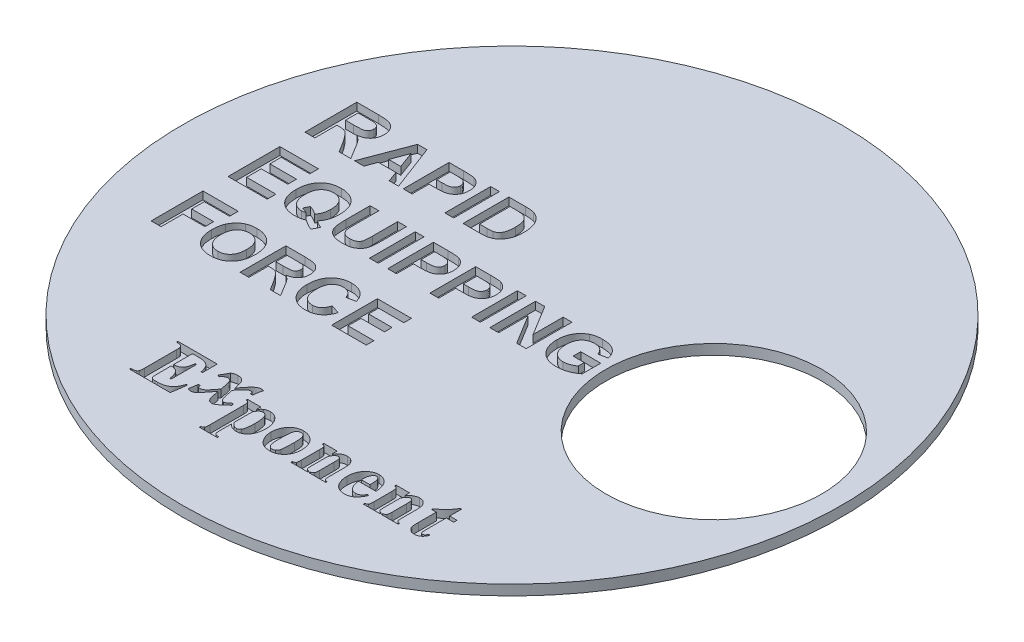
from build123d import *

# Parameters (mm, degrees)
SKETCH1_R           = 20.828
BOSS_EXTRUDE1_DEPTH = 1.27
CUT_EXTRUDE2_START  = -0.635
SKETCH2_R           = 20.828
SKETCH2_R_2         = 20.32
CUT_EXTRUDE2_DEPTH  = 0.635
CUT_EXTRUDE3_DEPTH  = 30.482606194
BOSS_EXTRUDE2_START = -1.27
SKETCH16_R          = 22.86
SKETCH16_R_2        = 20.32
BOSS_EXTRUDE2_DEPTH = 1.27
SKETCH17_R          = 7.493
CUT_EXTRUDE6_DEPTH  = 33.353857575
SKETCH18_R          = 22.86
CUT_EXTRUDE7_DEPTH  = 0.5588
SKETCH20_W          = 0.610576923
SKETCH20_H          = 3.175
CUT_EXTRUDE8_DEPTH  = 0.5334


with BuildPart() as part:
    # Sketch1 → Boss-Extrude1 (new body)
    with BuildSketch(Plane(origin=(0, 0, 0), x_dir=(1, 0, 0), z_dir=(0, 1, 0))):
        with Locations(Location((0, 0, 0), (0, 0, 270))):
            Circle(SKETCH1_R)
    extrude(amount=BOSS_EXTRUDE1_DEPTH)

    # Sketch2 → Cut-Extrude2 (cut)
    with BuildSketch(Plane(origin=(0, 1.27, 0), x_dir=(1, 0, 0), z_dir=(0, 1, 0)).offset(CUT_EXTRUDE2_START)):
        with Locations(Location((0, 0, 0), (0, 0, 270))):
            Circle(SKETCH2_R)
        with Locations(Location((0, 0, 0), (0, 0, 270))):
            Circle(SKETCH2_R_2, mode=Mode.SUBTRACT)
    extrude(amount=CUT_EXTRUDE2_DEPTH, mode=Mode.SUBTRACT)

    # Sketch3 → Cut-Extrude3 (cut, through all)
    with BuildSketch(Plane(origin=(0, 1.27, 0), x_dir=(1, 0, 0), z_dir=(0, 1, 0))):
        with BuildLine():
            Line((18.66773, 2.835365662), (18.66773, -2.835365662))
            ThreePointArc((18.66773, -2.835365662), (14.00048, -5.461), (9.33323, -2.835365662))
            Line((9.33323, -2.835365662), (9.33323, 2.835365662))
            ThreePointArc((9.33323, 2.835365662), (14.00048, 5.461), (18.66773, 2.835365662))
        make_face()
    extrude(amount=-CUT_EXTRUDE3_DEPTH, mode=Mode.SUBTRACT)

    # Sketch16 → Boss-Extrude2 (add)
    with BuildSketch(Plane(origin=(0, 1.27, 0), x_dir=(1, 0, 0), z_dir=(0, 1, 0)).offset(BOSS_EXTRUDE2_START)):
        with Locations(Location((0, 0, 0), (0, 0, 270))):
            Circle(SKETCH16_R)
        Circle(SKETCH16_R_2, mode=Mode.SUBTRACT)
    extrude(amount=BOSS_EXTRUDE2_DEPTH)

    # Sketch17 → Cut-Extrude6 (cut, through all)
    with BuildSketch(Plane(origin=(0, 1.27, 0), x_dir=(1, 0, 0), z_dir=(0, 1, 0))):
        with Locations(Location((14.00048, 0, 0), (0, 0, 270))):
            Circle(SKETCH17_R)
    extrude(amount=-CUT_EXTRUDE6_DEPTH, mode=Mode.SUBTRACT)

    # Sketch18 → Cut-Extrude7 (cut)
    with BuildSketch(Plane.XZ):
        with Locations(Location((0, 0, 0), (0, 0, 90))):
            Circle(SKETCH18_R)
    extrude(amount=-CUT_EXTRUDE7_DEPTH, mode=Mode.SUBTRACT)

    # Sketch20 → Cut-Extrude8 (cut)
    # profile 1 of 27: a face of its own
    with BuildSketch(Plane(origin=(0, 1.27, 0), x_dir=(1, 0, 0), z_dir=(0, 1, 0))):
        with BuildLine():
            Line((-18.173215779, 3.81), (-18.173215779, 7.405646159))
            Line((-18.173215779, 7.405646159), (-16.664225654, 7.405646159))
            add(Edge.make_bspline(
                [(-16.664225654, 7.405646159), (-16.618365952, 7.405363527), (-16.529985914, 7.404818842), (-16.402171137, 7.400846897), (-16.284297222, 7.392525439), (-16.175841279, 7.38310132), (-16.07732423, 7.369389834), (-15.988356556, 7.352963609), (-15.909088041, 7.333927878), (-15.83836211, 7.311129504), (-15.773874428, 7.285035973), (-15.713800989, 7.25397733), (-15.657481267, 7.217588312), (-15.604050246, 7.177123149), (-15.553281667, 7.132519664), (-15.506567336, 7.082597429), (-15.463093365, 7.028099802), (-15.422894831, 6.969480207), (-15.387482439, 6.906997485), (-15.35512481, 6.842658281), (-15.32878448, 6.775777931), (-15.307027607, 6.70667149), (-15.28964788, 6.635488998), (-15.277584882, 6.562049484), (-15.270054082, 6.486485874), (-15.269381807, 6.435444846), (-15.269040035, 6.409496592)],
                knots=[0, 0, 0, 0, 1.675828044, 3.229627355, 4.67171229, 5.993455049, 7.206927059, 8.304770529, 9.29850117, 10.183580433, 11.017754134, 11.837875825, 12.650738409, 13.464925643, 14.285328857, 15.117007378, 15.959673368, 16.830859064, 17.711229498, 18.58228265, 19.460420693, 20.334473227, 21.228207035, 22.135446768, 23.052097822, 24, 24, 24, 24], degree=3))
            add(Edge.make_bspline(
                [(-15.269040035, 6.409496592), (-15.26967397, 6.376809054), (-15.270912854, 6.312928596), (-15.282313719, 6.219299724), (-15.299246916, 6.129844021), (-15.323385056, 6.044437553), (-15.356574509, 5.964084822), (-15.395103406, 5.887660201), (-15.441055589, 5.815422924), (-15.494118862, 5.748089113), (-15.55424572, 5.685599163), (-15.621699662, 5.629239071), (-15.695999089, 5.578788566), (-15.777593465, 5.534538579), (-15.865914646, 5.496709635), (-15.961345621, 5.464881513), (-16.063454374, 5.438976969), (-16.134481166, 5.426788106), (-16.170832701, 5.420549842)],
                knots=[0, 0, 0, 0, 1.05911256, 2.069797862, 3.05271628, 4.008392045, 4.940519534, 5.866323021, 6.779546087, 7.71056835, 8.640711998, 9.585328432, 10.554502533, 11.547017206, 12.589327225, 13.664782803, 14.804835066, 16, 16, 16, 16], degree=3))
            add(Edge.make_bspline(
                [(-16.170832701, 5.420549842), (-16.135676684, 5.397265681), (-16.066871568, 5.351695406), (-15.971674738, 5.276640592), (-15.886210572, 5.197864759), (-15.821501416, 5.127812388), (-15.771779099, 5.066208853), (-15.731744138, 5.012329808), (-15.688560015, 4.950322842), (-15.642650271, 4.880154358), (-15.592657699, 4.802445182), (-15.540441611, 4.716005855), (-15.484909313, 4.621679519), (-15.447572644, 4.555787797), (-15.428222287, 4.521638302)],
                knots=[0, 0, 0, 0, 1.285445069, 2.515791127, 3.691898215, 4.826622834, 5.420063933, 6.105349801, 6.873086501, 7.723915395, 8.66222816, 9.690593598, 10.803111229, 12, 12, 12, 12], degree=3))
            Line((-15.428222287, 4.521638302), (-14.992451869, 3.81))
            Line((-14.992451869, 3.81), (-15.800607917, 3.81))
            Line((-15.800607917, 3.81), (-16.312007911, 4.626079146))
            add(Edge.make_bspline(
                [(-16.312007911, 4.626079146), (-16.335494448, 4.658762527), (-16.380335074, 4.72116182), (-16.445065289, 4.809833241), (-16.504287691, 4.888766732), (-16.556426174, 4.959105598), (-16.604118923, 5.018855568), (-16.645917797, 5.069057877), (-16.680971407, 5.110789792), (-16.720634653, 5.152168787), (-16.76677863, 5.194694869), (-16.823901186, 5.235926325), (-16.882560753, 5.268795607), (-16.945409792, 5.293875642), (-17.018092807, 5.311363108), (-17.105469302, 5.322504847), (-17.210286598, 5.330725097), (-17.286048503, 5.33105636), (-17.326884802, 5.331234913)],
                knots=[0, 0, 0, 0, 1.465447777, 2.797841088, 3.997266218, 5.05856206, 5.985598736, 6.780315439, 7.437430484, 7.969193402, 8.866571936, 9.718200644, 10.52825214, 11.309096006, 12.174169268, 13.242355782, 14.513606761, 16, 16, 16, 16], degree=3))
            Line((-17.326884802, 5.331234913), (-17.481745363, 5.331234913))
            Line((-17.481745363, 5.331234913), (-17.481745363, 3.81))
            Line((-17.481745363, 3.81), (-18.173215779, 3.81))
        make_face()
        with BuildLine():
            Line((-17.481745363, 5.930509273), (-16.924967623, 5.930509273))
            add(Edge.make_bspline(
                [(-16.924967623, 5.930509273), (-16.881988741, 5.93060138), (-16.800106708, 5.930776858), (-16.683668828, 5.933318588), (-16.579650594, 5.935475902), (-16.488674477, 5.940896245), (-16.410333441, 5.946268316), (-16.344941754, 5.953250058), (-16.29194847, 5.961502253), (-16.239017088, 5.974332249), (-16.184797367, 5.996685984), (-16.127009403, 6.028524283), (-16.07761946, 6.06982719), (-16.034836362, 6.117577528), (-16.002198852, 6.173712393), (-15.976635963, 6.235730914), (-15.963675036, 6.305011196), (-15.961587415, 6.353031454), (-15.96051045, 6.377804198)],
                knots=[0, 0, 0, 0, 1.697953026, 3.23488743, 4.60134403, 5.807846676, 6.835100678, 7.703488618, 8.405232423, 8.952775585, 9.851109663, 10.713519226, 11.549115941, 12.382556273, 13.233359028, 14.101746968, 15.020727134, 16, 16, 16, 16], degree=3))
            add(Edge.make_bspline(
                [(-15.96051045, 6.377804198), (-15.961735295, 6.405517633), (-15.964098435, 6.458986238), (-15.982734495, 6.535072573), (-16.015262979, 6.602284374), (-16.059936934, 6.660732609), (-16.116018047, 6.710087143), (-16.182816853, 6.749263899), (-16.259837086, 6.778441122), (-16.315389052, 6.789216214), (-16.344420587, 6.794847292)],
                knots=[0, 0, 0, 0, 1.062977961, 2.050844577, 2.982300261, 3.90936959, 4.856017476, 5.831122378, 6.86654153, 8, 8, 8, 8], degree=3))
            add(Edge.make_bspline(
                [(-16.344420587, 6.794847292), (-16.35401699, 6.795901731), (-16.376762481, 6.798400971), (-16.41692832, 6.800006124), (-16.468285499, 6.802473418), (-16.531455645, 6.803481746), (-16.605874399, 6.805249256), (-16.691837683, 6.805573816), (-16.789072386, 6.806610761), (-16.857740917, 6.806454369), (-16.893995511, 6.806371799)],
                knots=[0, 0, 0, 0, 0.42127143, 0.998501726, 1.753681744, 2.66564073, 3.755712164, 5.002818897, 6.417592707, 8, 8, 8, 8], degree=3))
            Line((-16.893995511, 6.806371799), (-17.481745363, 6.806371799))
            Line((-17.481745363, 6.806371799), (-17.481745363, 5.930509273))
        make_face(mode=Mode.SUBTRACT)
    # profile 2 of 27: a face of its own
    with BuildSketch(Plane(origin=(0, 1.27, 0), x_dir=(1, 0, 0), z_dir=(0, 1, 0))):
        Polygon((-18.173215779, -1.524), (-18.173215779, 2.071646159), (-15.499530173, 2.071646159), (-15.499530173, 1.472371799), (-17.481745363, 1.472371799), (-17.481745363, 0.688705329), (-15.637824256, 0.688705329), (-15.637824256, 0.089430969), (-17.481745363, 0.089430969), (-17.481745363, -0.92472564), (-15.453432146, -0.92472564), (-15.453432146, -1.524), align=None)
    # profile 3 of 27: a face of its own
    with BuildSketch(Plane(origin=(0, 1.27, 0), x_dir=(1, 0, 0), z_dir=(0, 1, 0))):
        Polygon((-18.173215779, -6.858), (-18.173215779, -3.262353841), (-15.730020312, -3.262353841), (-15.730020312, -3.861628201), (-17.481745363, -3.861628201), (-17.481745363, -4.737490727), (-15.96051045, -4.737490727), (-15.96051045, -5.336765087), (-17.481745363, -5.336765087), (-17.481745363, -6.858), align=None)
    # profile 4 of 27: a face of its own
    with BuildSketch(Plane(origin=(0, 1.27, 0), x_dir=(1, 0, 0), z_dir=(0, 1, 0))):
        Polygon((-11.679115385, 3.81), (-12.32658133, 3.81), (-12.594344752, 4.542692308), (-13.812954527, 4.542692308), (-14.080717949, 3.81), (-14.732, 3.81), (-13.531834736, 6.985), (-12.885004808, 6.985), align=None)
        Polygon((-12.788330128, 5.071858974), (-13.205557692, 6.211602564), (-13.621513221, 5.071858974), align=None, mode=Mode.SUBTRACT)
    # profile 5 of 27: a face of its own
    with BuildSketch(Plane(origin=(0, 1.27, 0), x_dir=(1, 0, 0), z_dir=(0, 1, 0))):
        with BuildLine():
            Line((-11.353474359, 3.81), (-11.353474359, 6.985))
            Line((-11.353474359, 6.985), (-10.337754207, 6.985))
            add(Edge.make_bspline(
                [(-10.337754207, 6.985), (-10.291747428, 6.984949758), (-10.203753994, 6.984853665), (-10.078236683, 6.9821838), (-9.965227149, 6.97840431), (-9.864893116, 6.973697116), (-9.776881535, 6.966673079), (-9.701587217, 6.958539349), (-9.638536037, 6.949789614), (-9.601407066, 6.940734809), (-9.584709335, 6.93666266)],
                knots=[0, 0, 0, 0, 1.460485487, 2.793352117, 3.985295279, 5.050041172, 5.981765236, 6.787433016, 7.454681457, 8, 8, 8, 8], degree=3))
            add(Edge.make_bspline(
                [(-9.584709335, 6.93666266), (-9.562505414, 6.930331467), (-9.518435832, 6.917765531), (-9.455297864, 6.890976951), (-9.394442861, 6.859930417), (-9.336635401, 6.82292856), (-9.281678978, 6.780628294), (-9.229410236, 6.733374582), (-9.179550433, 6.680954113), (-9.132789317, 6.623470439), (-9.089961635, 6.561213423), (-9.052947757, 6.494091019), (-9.021937866, 6.422394976), (-8.995517955, 6.346664081), (-8.976025219, 6.266086375), (-8.962383847, 6.181221722), (-8.95288775, 6.092033004), (-8.952215397, 6.030999519), (-8.951871795, 5.999808694)],
                knots=[0, 0, 0, 0, 0.907145743, 1.80047177, 2.69161667, 3.591261238, 4.495029544, 5.415863088, 6.359363025, 7.337192411, 8.326890979, 9.326929023, 10.346104993, 11.395420813, 12.477187422, 13.601053412, 14.774031606, 16, 16, 16, 16], degree=3))
            add(Edge.make_bspline(
                [(-8.951871795, 5.999808694), (-8.952851747, 5.95244188), (-8.954738208, 5.861258162), (-8.975844364, 5.730535251), (-9.008036443, 5.611128299), (-9.055087494, 5.504187442), (-9.112452498, 5.409293027), (-9.175641232, 5.323746161), (-9.247793479, 5.250125311), (-9.325747618, 5.187242374), (-9.408130895, 5.135781587), (-9.490663303, 5.091911996), (-9.574458496, 5.058183654), (-9.631589872, 5.043487943), (-9.659759415, 5.036241987)],
                knots=[0, 0, 0, 0, 1.312386234, 2.526415563, 3.661883817, 4.733421185, 5.753802465, 6.732107337, 7.675884281, 8.604170108, 9.50284679, 10.365392406, 11.194030444, 12, 12, 12, 12], degree=3))
            add(Edge.make_bspline(
                [(-9.659759415, 5.036241987), (-9.679865454, 5.032417346), (-9.722246584, 5.024355459), (-9.789460521, 5.016319225), (-9.862928997, 5.00742399), (-9.942954193, 5.001622018), (-10.029439299, 4.996188715), (-10.122350733, 4.993623473), (-10.221555714, 4.990532877), (-10.289837817, 4.990477343), (-10.325033854, 4.990448718)],
                knots=[0, 0, 0, 0, 0.735353946, 1.55003838, 2.431865514, 3.394945452, 4.432993119, 5.54609699, 6.735134699, 8, 8, 8, 8], degree=3))
            Line((-10.325033854, 4.990448718), (-10.742897436, 4.990448718))
            Line((-10.742897436, 4.990448718), (-10.742897436, 3.81))
            Line((-10.742897436, 3.81), (-11.353474359, 3.81))
        make_face()
        with BuildLine():
            Line((-10.742897436, 6.455833333), (-10.742897436, 5.519615385))
            Line((-10.742897436, 5.519615385), (-10.376551282, 5.519615385))
            add(Edge.make_bspline(
                [(-10.376551282, 5.519615385), (-10.344959632, 5.519656293), (-10.284520831, 5.519734556), (-10.197804557, 5.522543744), (-10.119308905, 5.525972879), (-10.048869859, 5.531648799), (-9.986912608, 5.539129525), (-9.93302224, 5.548077416), (-9.887135947, 5.557679438), (-9.837516168, 5.573591528), (-9.784462703, 5.599335837), (-9.727807838, 5.636336876), (-9.678036606, 5.680575981), (-9.636620344, 5.732533279), (-9.60353792, 5.790260847), (-9.57985088, 5.853167074), (-9.564556181, 5.920209385), (-9.56315915, 5.966651331), (-9.562448718, 5.990268429)],
                knots=[0, 0, 0, 0, 1.411705958, 2.700771114, 3.876961699, 4.922619712, 5.858038221, 6.66485904, 7.363650596, 7.950905807, 8.989198271, 9.987739806, 10.967313358, 11.951275539, 12.944273208, 13.927870418, 14.946261014, 16, 16, 16, 16], degree=3))
            add(Edge.make_bspline(
                [(-9.562448718, 5.990268429), (-9.563448573, 6.019033687), (-9.565387159, 6.074805729), (-9.586764353, 6.154234424), (-9.619746921, 6.226316929), (-9.66690263, 6.288810429), (-9.723865616, 6.341362324), (-9.787889635, 6.385087369), (-9.860341948, 6.415686488), (-9.911618767, 6.427542517), (-9.937699119, 6.433572716)],
                knots=[0, 0, 0, 0, 1.085904563, 2.105425768, 3.088705091, 4.068969419, 5.045188284, 6.010769642, 6.988240112, 8, 8, 8, 8], degree=3))
            add(Edge.make_bspline(
                [(-9.937699119, 6.433572716), (-9.94892209, 6.435367739), (-9.973833607, 6.439352133), (-10.015241617, 6.443510344), (-10.0642273, 6.447292232), (-10.120849703, 6.450397275), (-10.184884388, 6.4528247), (-10.256542572, 6.454951723), (-10.335635528, 6.455122601), (-10.3909682, 6.455589859), (-10.419800481, 6.455833333)],
                knots=[0, 0, 0, 0, 0.564603001, 1.253243608, 2.066786758, 3.005752288, 4.070476343, 5.250658742, 6.567396469, 8, 8, 8, 8], degree=3))
            Line((-10.419800481, 6.455833333), (-10.742897436, 6.455833333))
        make_face(mode=Mode.SUBTRACT)
    # profile 6 of 27: a face of its own
    with BuildSketch(Plane(origin=(0, 1.27, 0), x_dir=(1, 0, 0), z_dir=(0, 1, 0))):
        with Locations((-8.158121795, 5.3975)):
            Rectangle(SKETCH20_W, SKETCH20_H)
    # profile 7 of 27: a face of its own
    with BuildSketch(Plane(origin=(0, 1.27, 0), x_dir=(1, 0, 0), z_dir=(0, 1, 0))):
        with BuildLine():
            Line((-7.201551282, 6.985), (-6.037003005, 6.985))
            add(Edge.make_bspline(
                [(-6.037003005, 6.985), (-6.005197301, 6.985016488), (-5.943264207, 6.985048595), (-5.853383073, 6.981319834), (-5.769332657, 6.97756919), (-5.691354205, 6.970061221), (-5.619177186, 6.962191539), (-5.55267208, 6.952227929), (-5.492259004, 6.939458472), (-5.454162553, 6.929388228), (-5.435966346, 6.924578325)],
                knots=[0, 0, 0, 0, 1.259756885, 2.453039283, 3.563158368, 4.591894114, 5.55549294, 6.43918076, 7.254497783, 8, 8, 8, 8], degree=3))
            add(Edge.make_bspline(
                [(-5.435966346, 6.924578325), (-5.413210878, 6.917161963), (-5.368109822, 6.902462825), (-5.301990286, 6.876707488), (-5.239345469, 6.844765676), (-5.177851322, 6.811188889), (-5.120253119, 6.771488244), (-5.063502651, 6.730185038), (-5.011282931, 6.682339593), (-4.942803485, 6.615472435), (-4.864663232, 6.522324368), (-4.782799409, 6.398768138), (-4.713509831, 6.263148176), (-4.666168005, 6.141637413), (-4.634200966, 6.038343), (-4.613304462, 5.955527073), (-4.595554152, 5.868291056), (-4.580981093, 5.776612957), (-4.569658246, 5.680492763), (-4.561228266, 5.579956095), (-4.557122015, 5.474916103), (-4.556192292, 5.403438805), (-4.555717949, 5.366971154)],
                knots=[0, 0, 0, 0, 0.745524535, 1.477620414, 2.207090574, 2.934465325, 3.657932502, 4.384347339, 5.118673636, 5.861150177, 7.365375624, 8.894729774, 10.468936425, 12.099947606, 12.950091786, 13.83580991, 14.759228729, 15.722225242, 16.726454549, 17.773376212, 18.863978586, 20, 20, 20, 20], degree=3))
            add(Edge.make_bspline(
                [(-4.555717949, 5.366971154), (-4.556583844, 5.303943859), (-4.558258467, 5.182050335), (-4.577659087, 5.00615849), (-4.605617832, 4.842786883), (-4.637133137, 4.740868572), (-4.652392628, 4.691520433)],
                knots=[0, 0, 0, 0, 1.103207939, 2.133582005, 3.096293362, 4, 4, 4, 4], degree=3))
            add(Edge.make_bspline(
                [(-4.652392628, 4.691520433), (-4.662468949, 4.663203395), (-4.682290643, 4.607499364), (-4.716977123, 4.527146025), (-4.754456109, 4.450677939), (-4.795038474, 4.378155353), (-4.838929253, 4.309904476), (-4.886292613, 4.246129449), (-4.936394384, 4.185990655), (-4.972690219, 4.148974943), (-4.990754006, 4.130552885)],
                knots=[0, 0, 0, 0, 1.090884612, 2.145940218, 3.175104604, 4.181306866, 5.161203701, 6.118658341, 7.063689906, 8, 8, 8, 8], degree=3))
            add(Edge.make_bspline(
                [(-4.990754006, 4.130552885), (-5.019985579, 4.104264701), (-5.080265249, 4.050054721), (-5.186488351, 3.982967703), (-5.306550325, 3.92368777), (-5.393395817, 3.893236652), (-5.438510417, 3.877417869)],
                knots=[0, 0, 0, 0, 0.908140292, 1.872714733, 2.8949153, 4, 4, 4, 4], degree=3))
            add(Edge.make_bspline(
                [(-5.438510417, 3.877417869), (-5.456671333, 3.87184011), (-5.494363374, 3.860263762), (-5.554127823, 3.847899982), (-5.617927871, 3.834874618), (-5.686499222, 3.827027938), (-5.759130072, 3.818753266), (-5.836399222, 3.814107501), (-5.91803882, 3.810809277), (-5.974033418, 3.810273759), (-6.002658053, 3.81)],
                knots=[0, 0, 0, 0, 0.799129865, 1.658552685, 2.566799617, 3.538529252, 4.561352959, 5.643373779, 6.795284424, 8, 8, 8, 8], degree=3))
            Line((-6.002658053, 3.81), (-7.201551282, 3.81))
            Line((-7.201551282, 3.81), (-7.201551282, 6.985))
        make_face()
        with BuildLine():
            Line((-6.590974359, 6.455833333), (-6.590974359, 4.339166667))
            Line((-6.590974359, 4.339166667), (-6.088520433, 4.339166667))
            add(Edge.make_bspline(
                [(-6.088520433, 4.339166667), (-6.065835955, 4.33934657), (-6.02215967, 4.339692953), (-5.958958967, 4.340710757), (-5.900878052, 4.343466145), (-5.847612663, 4.346320277), (-5.79930147, 4.351035804), (-5.755734262, 4.355673704), (-5.717153557, 4.36216203), (-5.693325165, 4.367283828), (-5.682105168, 4.369695513)],
                knots=[0, 0, 0, 0, 1.333384787, 2.567275092, 3.714769766, 4.750907381, 5.701951617, 6.567520054, 7.325492842, 8, 8, 8, 8], degree=3))
            add(Edge.make_bspline(
                [(-5.682105168, 4.369695513), (-5.655826663, 4.376707922), (-5.604643067, 4.390366244), (-5.532776124, 4.420814576), (-5.467745799, 4.457547157), (-5.408463034, 4.501716507), (-5.355036991, 4.55753635), (-5.309431332, 4.628925551), (-5.267224497, 4.714067245), (-5.238321247, 4.795569139), (-5.217574549, 4.868364724), (-5.203530736, 4.929463856), (-5.192432291, 4.995566938), (-5.182886181, 5.066413085), (-5.175172696, 5.141911193), (-5.170373002, 5.222333898), (-5.16709718, 5.307582755), (-5.166567374, 5.366119801), (-5.166294872, 5.396227965)],
                knots=[0, 0, 0, 0, 1.038686998, 2.023088296, 2.974059649, 3.888265163, 4.839857954, 5.909819677, 7.113156087, 8.466843969, 9.20827164, 10.006482943, 10.861893492, 11.769681931, 12.739021491, 13.762258324, 14.849031541, 16, 16, 16, 16], degree=3))
            add(Edge.make_bspline(
                [(-5.166294872, 5.396227965), (-5.166565279, 5.426336221), (-5.167089107, 5.484661587), (-5.170359904, 5.569274788), (-5.175132639, 5.648431059), (-5.182901056, 5.722228251), (-5.192299186, 5.790768354), (-5.203527631, 5.854109371), (-5.217486785, 5.911835614), (-5.238251129, 5.980415457), (-5.269728806, 6.057501331), (-5.312563781, 6.141782856), (-5.365166604, 6.213618373), (-5.423287601, 6.276023062), (-5.490302093, 6.327378967), (-5.564486973, 6.370392528), (-5.647457459, 6.403777965), (-5.706476972, 6.417997917), (-5.736802684, 6.425304487)],
                knots=[0, 0, 0, 0, 1.117996097, 2.165769068, 3.143980016, 4.062055362, 4.920439205, 5.712587309, 6.449616741, 7.124491204, 8.371470382, 9.537068822, 10.625202851, 11.666538334, 12.693249444, 13.747832046, 14.842779399, 16, 16, 16, 16], degree=3))
            add(Edge.make_bspline(
                [(-5.736802684, 6.425304487), (-5.74992913, 6.427743565), (-5.778828538, 6.433113479), (-5.826784326, 6.439385571), (-5.88304715, 6.444039999), (-5.947903828, 6.448791761), (-6.021091749, 6.451503917), (-6.10291715, 6.454334493), (-6.193037629, 6.455301412), (-6.256005301, 6.455650931), (-6.288865986, 6.455833333)],
                knots=[0, 0, 0, 0, 0.578738571, 1.274160813, 2.095454135, 3.025967819, 4.093109015, 5.270126069, 6.575371698, 8, 8, 8, 8], degree=3))
            Line((-6.288865986, 6.455833333), (-6.590974359, 6.455833333))
        make_face(mode=Mode.SUBTRACT)
    # profile 8 of 27: a face of its own
    with BuildSketch(Plane(origin=(0, 1.27, 0), x_dir=(1, 0, 0), z_dir=(0, 1, 0))):
        with BuildLine():
            add(Edge.make_bspline(
                [(-12.409085537, -1.095960136), (-12.369828617, -1.122868136), (-12.291162242, -1.17678869), (-12.166036216, -1.246541749), (-12.036932572, -1.309954248), (-11.947208765, -1.34406199), (-11.902179487, -1.361179487)],
                knots=[0, 0, 0, 0, 0.994855506, 1.99357661, 2.993045438, 4, 4, 4, 4], degree=3))
            Line((-11.902179487, -1.361179487), (-12.135597957, -1.808935897))
            add(Edge.make_bspline(
                [(-12.135597957, -1.808935897), (-12.183317572, -1.794164235), (-12.279515438, -1.764386073), (-12.37032093, -1.720846377), (-12.416081731, -1.698904848)],
                knots=[0, 0, 0, 0, 0.992113803, 2, 2, 2, 2], degree=3))
            add(Edge.make_bspline(
                [(-12.416081731, -1.698904848), (-12.420572207, -1.696639222), (-12.433576021, -1.690078274), (-12.457195652, -1.673926781), (-12.493233469, -1.652157326), (-12.540144928, -1.622003865), (-12.598402108, -1.58462855), (-12.668193497, -1.540071705), (-12.748556603, -1.487073506), (-12.806350696, -1.449745914), (-12.837125401, -1.429869391)],
                knots=[0, 0, 0, 0, 0.241377655, 0.698997227, 1.371388316, 2.263975901, 3.376788369, 4.695767198, 6.240533187, 8, 8, 8, 8], degree=3))
            add(Edge.make_bspline(
                [(-12.837125401, -1.429869391), (-12.86264823, -1.440799666), (-12.913940613, -1.462765876), (-12.993522961, -1.489814248), (-13.075129041, -1.512599813), (-13.158468928, -1.531923452), (-13.243895358, -1.546281488), (-13.331287568, -1.557292445), (-13.420890541, -1.56374987), (-13.481401042, -1.564384724), (-13.511940104, -1.564705128)],
                knots=[0, 0, 0, 0, 0.961025642, 1.931341354, 2.907359807, 3.893838693, 4.891829695, 5.905170566, 6.942759923, 8, 8, 8, 8], degree=3))
            add(Edge.make_bspline(
                [(-13.511940104, -1.564705128), (-13.569868695, -1.563295216), (-13.683102566, -1.560539239), (-13.84821203, -1.541006891), (-14.003352376, -1.507151918), (-14.149204558, -1.460908689), (-14.284891833, -1.400202686), (-14.411604494, -1.32682301), (-14.527588199, -1.238865819), (-14.634440987, -1.13902685), (-14.728974968, -1.026182192), (-14.811732838, -0.902301632), (-14.881839997, -0.767795823), (-14.938370126, -0.62195644), (-14.983047152, -0.465962736), (-15.013507588, -0.298713494), (-15.033112209, -0.121200622), (-15.035334905, 0.000903803), (-15.036474359, 0.0635)],
                knots=[0, 0, 0, 0, 1.098101164, 2.146474535, 3.146072545, 4.104420533, 5.041773038, 5.958565538, 6.874115049, 7.795336865, 8.725215067, 9.658214839, 10.614563411, 11.594512188, 12.618591104, 13.685899083, 14.813688224, 16, 16, 16, 16], degree=3))
            add(Edge.make_bspline(
                [(-15.036474359, 0.0635), (-15.03533232, 0.126093643), (-15.033112275, 0.247771414), (-15.013641538, 0.424942288), (-14.982165341, 0.591593983), (-14.937943867, 0.747835561), (-14.880567051, 0.893256532), (-14.810185821, 1.027775452), (-14.727297841, 1.151917393), (-14.631643225, 1.264513241), (-14.525356933, 1.365373904), (-14.409036266, 1.452677346), (-14.28403365, 1.527217554), (-14.149852061, 1.587866226), (-14.006121086, 1.634083972), (-13.85393513, 1.667831165), (-13.692451688, 1.687602342), (-13.581956785, 1.690314414), (-13.525296474, 1.691705128)],
                knots=[0, 0, 0, 0, 1.193283781, 2.319662245, 3.393996131, 4.424093603, 5.411284417, 6.369670503, 7.313761776, 8.251713527, 9.181123148, 10.102053383, 11.01932051, 11.951118596, 12.903560284, 13.893239571, 14.919681386, 16, 16, 16, 16], degree=3))
            add(Edge.make_bspline(
                [(-13.525296474, 1.691705128), (-13.469043126, 1.690682569), (-13.359325656, 1.688688152), (-13.199342154, 1.667357403), (-13.048171977, 1.634993395), (-12.905635305, 1.588340647), (-12.772462444, 1.52775342), (-12.647960324, 1.454192961), (-12.532855052, 1.367037877), (-12.427114048, 1.26713966), (-12.332539441, 1.154932302), (-12.248759541, 1.032261271), (-12.179974472, 0.897614303), (-12.122027304, 0.753275863), (-12.078830711, 0.597838231), (-12.046942846, 0.432192512), (-12.027741954, 0.255816787), (-12.025463229, 0.134570244), (-12.024294872, 0.072404247)],
                knots=[0, 0, 0, 0, 1.078752742, 2.104017338, 3.091035458, 4.041673215, 4.975566109, 5.892967701, 6.810684895, 7.740128604, 8.678185021, 9.621404646, 10.583875016, 11.573429805, 12.6009998, 13.674031063, 14.80742018, 16, 16, 16, 16], degree=3))
            add(Edge.make_bspline(
                [(-12.024294872, 0.072404247), (-12.025555189, 0.006831571), (-12.028005208, -0.120639755), (-12.049327613, -0.305756888), (-12.083891946, -0.479123131), (-12.1195012, -0.588068345), (-12.136869992, -0.641207532)],
                knots=[0, 0, 0, 0, 1.083667057, 2.106616435, 3.076482036, 4, 4, 4, 4], degree=3))
            add(Edge.make_bspline(
                [(-12.136869992, -0.641207532), (-12.152439611, -0.680348908), (-12.184113184, -0.759974953), (-12.246720233, -0.874910253), (-12.321209982, -0.988302941), (-12.379378446, -1.059565691), (-12.409085537, -1.095960136)],
                knots=[0, 0, 0, 0, 0.948216854, 1.928975575, 2.942311585, 4, 4, 4, 4], degree=3))
        make_face()
        with BuildLine():
            add(Edge.make_bspline(
                [(-12.918535657, -0.769047075), (-12.895579433, -0.743949949), (-12.849612044, -0.693695633), (-12.792768947, -0.607618967), (-12.743140806, -0.515311712), (-12.704122129, -0.414470916), (-12.672741014, -0.306632163), (-12.650839645, -0.190993687), (-12.637237263, -0.067846187), (-12.63567461, 0.016821704), (-12.634871795, 0.060319912)],
                knots=[0, 0, 0, 0, 0.906820982, 1.815812261, 2.745108282, 3.70056618, 4.696560745, 5.740060838, 6.83895416, 8, 8, 8, 8], degree=3))
            add(Edge.make_bspline(
                [(-12.634871795, 0.060319912), (-12.635575901, 0.105075252), (-12.636939867, 0.191773493), (-12.648237405, 0.317671794), (-12.668118286, 0.434698452), (-12.694065203, 0.543341616), (-12.729417426, 0.64272196), (-12.772052016, 0.733588566), (-12.822036046, 0.81616501), (-12.880597819, 0.889088874), (-12.945010279, 0.953199326), (-13.01386632, 1.009834127), (-13.088171832, 1.057240956), (-13.167548364, 1.095376812), (-13.251331667, 1.125384041), (-13.339720247, 1.147168604), (-13.432913478, 1.159916791), (-13.496636512, 1.161653406), (-13.52911258, 1.162538462)],
                knots=[0, 0, 0, 0, 1.335693338, 2.587451293, 3.768164612, 4.876224393, 5.916940853, 6.910477009, 7.867661778, 8.790666633, 9.694493319, 10.576027549, 11.446684429, 12.318352473, 13.199023277, 14.098364444, 15.030842682, 16, 16, 16, 16], degree=3))
            add(Edge.make_bspline(
                [(-13.52911258, 1.162538462), (-13.561806075, 1.161682127), (-13.625751897, 1.160007205), (-13.719036841, 1.146949892), (-13.807627124, 1.126214663), (-13.891305862, 1.095970388), (-13.970829547, 1.057762187), (-14.045412698, 1.01044317), (-14.115044921, 0.95469766), (-14.179781772, 0.890991999), (-14.237601202, 0.818045053), (-14.288998108, 0.736906483), (-14.331487327, 0.646642406), (-14.365607654, 0.547759282), (-14.392875326, 0.440765274), (-14.412511274, 0.32508621), (-14.423823564, 0.200895859), (-14.4251923, 0.115253087), (-14.425897436, 0.071132212)],
                knots=[0, 0, 0, 0, 0.980107447, 1.917010591, 2.819119613, 3.703969481, 4.579773866, 5.459928929, 6.346604172, 7.250235365, 8.177620171, 9.131899985, 10.124404622, 11.161948974, 12.264485933, 13.431998172, 14.677033863, 16, 16, 16, 16], degree=3))
            add(Edge.make_bspline(
                [(-14.425897436, 0.071132212), (-14.425209654, 0.026373068), (-14.423874067, -0.060543709), (-14.412315479, -0.186565243), (-14.393576886, -0.303979922), (-14.36690216, -0.412739148), (-14.332797435, -0.512967168), (-14.290789594, -0.604524313), (-14.241101346, -0.687296089), (-14.183572751, -0.760531478), (-14.120285837, -0.824960869), (-14.052661075, -0.881129331), (-13.981247358, -0.929245544), (-13.905711556, -0.968339867), (-13.826033411, -0.9983632), (-13.742490776, -1.020031607), (-13.654597471, -1.032947087), (-13.594665694, -1.034663098), (-13.56409355, -1.035538462)],
                knots=[0, 0, 0, 0, 1.356840463, 2.634818045, 3.833173645, 4.958776583, 6.025986406, 7.038359119, 8.007356852, 8.946032033, 9.855123386, 10.740685277, 11.607120956, 12.460971081, 13.313368256, 14.183325659, 15.073285775, 16, 16, 16, 16], degree=3))
            add(Edge.make_bspline(
                [(-13.56409355, -1.035538462), (-13.541166182, -1.035136197), (-13.496004036, -1.03434382), (-13.429281995, -1.025436825), (-13.364287777, -1.012560652), (-13.32230867, -0.99944976), (-13.301418269, -0.99292528)],
                knots=[0, 0, 0, 0, 1.028828871, 2.026578908, 3.017950568, 4, 4, 4, 4], degree=3))
            add(Edge.make_bspline(
                [(-13.301418269, -0.99292528), (-13.333446085, -0.976190344), (-13.396869438, -0.943050846), (-13.494925025, -0.900825084), (-13.593176537, -0.862780645), (-13.659999583, -0.842226524), (-13.693205128, -0.832012821)],
                knots=[0, 0, 0, 0, 1.021704821, 2.023239566, 3.017713044, 4, 4, 4, 4], degree=3))
            Line((-13.693205128, -0.832012821), (-13.51575621, -0.465666667))
            add(Edge.make_bspline(
                [(-13.51575621, -0.465666667), (-13.463863397, -0.483599316), (-13.359576912, -0.519637698), (-13.208930445, -0.59119754), (-13.060383328, -0.672642582), (-12.96617379, -0.736670583), (-12.918535657, -0.769047075)],
                knots=[0, 0, 0, 0, 0.979271047, 1.967993817, 2.972492781, 4, 4, 4, 4], degree=3))
        make_face(mode=Mode.SUBTRACT)
    # profile 9 of 27: a face of its own
    with BuildSketch(Plane(origin=(0, 1.27, 0), x_dir=(1, 0, 0), z_dir=(0, 1, 0))):
        with BuildLine():
            Line((-11.495128205, 1.651), (-10.884551282, 1.651))
            Line((-10.884551282, 1.651), (-10.884551282, -0.071971755))
            add(Edge.make_bspline(
                [(-10.884551282, -0.071971755), (-10.884318186, -0.104620624), (-10.883873185, -0.166950413), (-10.883566865, -0.256000487), (-10.881871655, -0.335953679), (-10.878195425, -0.406938823), (-10.875672326, -0.468919717), (-10.870987207, -0.521907738), (-10.866313443, -0.56588225), (-10.861769421, -0.592038653), (-10.859746595, -0.603682492)],
                knots=[0, 0, 0, 0, 1.470600056, 2.807515117, 4.011048972, 5.072079398, 6.00911328, 6.804506435, 7.467811572, 8, 8, 8, 8], degree=3))
            add(Edge.make_bspline(
                [(-10.859746595, -0.603682492), (-10.851406983, -0.635072581), (-10.834985236, -0.69688363), (-10.789720862, -0.781377693), (-10.729927262, -0.855853888), (-10.668935586, -0.908967404), (-10.613763917, -0.946557209), (-10.566900105, -0.969434907), (-10.517177906, -0.990289399), (-10.463546167, -1.006290874), (-10.406580496, -1.020292741), (-10.345592808, -1.028388718), (-10.281097803, -1.03460218), (-10.236890584, -1.035220786), (-10.214188702, -1.035538462)],
                knots=[0, 0, 0, 0, 1.376921055, 2.711331395, 4.038631339, 5.418057255, 6.132954575, 6.870556231, 7.630397752, 8.422890386, 9.247036838, 10.121396817, 11.035274583, 12, 12, 12, 12], degree=3))
            add(Edge.make_bspline(
                [(-10.214188702, -1.035538462), (-10.191284985, -1.03512306), (-10.146691916, -1.034314281), (-10.082068946, -1.029497721), (-10.02177682, -1.020410532), (-9.965852421, -1.008495473), (-9.914000376, -0.993436835), (-9.866634352, -0.974370829), (-9.823828991, -0.951426619), (-9.773533337, -0.916844026), (-9.71941528, -0.86805924), (-9.667333559, -0.801730093), (-9.630059079, -0.728509929), (-9.612575768, -0.661654443), (-9.603589933, -0.603405311), (-9.598115279, -0.552435298), (-9.593108432, -0.494754929), (-9.588561831, -0.430522189), (-9.585452539, -0.359688864), (-9.583770778, -0.282075813), (-9.582447223, -0.197695413), (-9.582144183, -0.139178189), (-9.581987179, -0.108860777)],
                knots=[0, 0, 0, 0, 1.036876239, 2.018776863, 2.930845756, 3.794842666, 4.605604932, 5.371924355, 6.101864688, 6.799283669, 8.1310906, 9.382718023, 10.597336334, 11.822035891, 12.492591141, 13.265194674, 14.141890321, 15.11351293, 16.179860579, 17.351049011, 18.627594861, 20, 20, 20, 20], degree=3))
            Line((-9.581987179, -0.108860777), (-9.581987179, 1.651))
            Line((-9.581987179, 1.651), (-8.971410256, 1.651))
            Line((-8.971410256, 1.651), (-8.971410256, -0.009642027))
            add(Edge.make_bspline(
                [(-8.971410256, -0.009642027), (-8.971488515, -0.055435755), (-8.971638888, -0.143427144), (-8.973986742, -0.270024799), (-8.978976679, -0.386172841), (-8.98315532, -0.492070363), (-8.991215747, -0.587447212), (-8.999654987, -0.672362688), (-9.010526649, -0.746801951), (-9.02602974, -0.831412991), (-9.052083694, -0.926341134), (-9.094073708, -1.031201442), (-9.147738209, -1.126601876), (-9.212863354, -1.212908478), (-9.28907397, -1.290464275), (-9.377511149, -1.358964371), (-9.477265497, -1.419241532), (-9.568678835, -1.462644855), (-9.648379555, -1.49187123), (-9.713294458, -1.511650331), (-9.782768289, -1.528122185), (-9.856719568, -1.541194065), (-9.93518007, -1.552215594), (-10.018178282, -1.55957617), (-10.105588638, -1.564169688), (-10.165209258, -1.564523779), (-10.195744191, -1.564705128)],
                knots=[0, 0, 0, 0, 1.415574045, 2.719986624, 3.913607924, 5.00929969, 5.995467356, 6.871900228, 7.64671288, 8.320227872, 9.530145585, 10.682614022, 11.803571353, 12.90325401, 14.015460715, 15.154679255, 16.351678057, 17.612271512, 18.275764165, 18.974412946, 19.708786676, 20.481351116, 21.295095879, 22.157200529, 23.056203067, 24, 24, 24, 24], degree=3))
            add(Edge.make_bspline(
                [(-10.195744191, -1.564705128), (-10.232423778, -1.564236268), (-10.303477605, -1.563328015), (-10.406618143, -1.559276379), (-10.502718877, -1.550913646), (-10.592081738, -1.539610629), (-10.67466983, -1.525080231), (-10.750692082, -1.507709232), (-10.819541566, -1.48575474), (-10.901546827, -1.454398417), (-10.99295537, -1.406433755), (-11.092457436, -1.342449287), (-11.179803139, -1.270231453), (-11.254225016, -1.190485914), (-11.316438808, -1.106015108), (-11.367007629, -1.01864689), (-11.407531817, -0.92983749), (-11.424465124, -0.86811322), (-11.432798478, -0.837736979)],
                knots=[0, 0, 0, 0, 1.128613534, 2.186292659, 3.174878439, 4.095586888, 4.95671962, 5.754129884, 6.492676435, 7.178284149, 8.453103036, 9.659838108, 10.813193309, 11.929983019, 13.007587775, 14.033493319, 15.032227051, 16, 16, 16, 16], degree=3))
            add(Edge.make_bspline(
                [(-11.432798478, -0.837736979), (-11.437898784, -0.813822101), (-11.448641659, -0.763449719), (-11.460842584, -0.683367507), (-11.471973422, -0.595183578), (-11.47957593, -0.498793628), (-11.486782411, -0.394503482), (-11.49195641, -0.282116503), (-11.494083963, -0.161658208), (-11.494773112, -0.078544283), (-11.495128205, -0.03571875)],
                knots=[0, 0, 0, 0, 0.728071598, 1.533551606, 2.411422299, 3.374601532, 4.412367648, 5.524718474, 6.72457895, 8, 8, 8, 8], degree=3))
            Line((-11.495128205, -0.03571875), (-11.495128205, 1.651))
        make_face()
    # profile 10 of 27: a face of its own
    with BuildSketch(Plane(origin=(0, 1.27, 0), x_dir=(1, 0, 0), z_dir=(0, 1, 0))):
        with Locations((-8.055544872, 0.0635)):
            Rectangle(SKETCH20_W, SKETCH20_H)
    # profile 11 of 27: a face of its own
    with BuildSketch(Plane(origin=(0, 1.27, 0), x_dir=(1, 0, 0), z_dir=(0, 1, 0))):
        with BuildLine():
            Line((-7.098974359, -1.524), (-7.098974359, 1.651))
            Line((-7.098974359, 1.651), (-6.083254207, 1.651))
            add(Edge.make_bspline(
                [(-6.083254207, 1.651), (-6.037247428, 1.650949758), (-5.949253994, 1.650853665), (-5.823736683, 1.6481838), (-5.710727149, 1.64440431), (-5.610393116, 1.639697116), (-5.522381535, 1.632673079), (-5.447087217, 1.624539349), (-5.384036037, 1.615789614), (-5.346907066, 1.606734809), (-5.330209335, 1.60266266)],
                knots=[0, 0, 0, 0, 1.460485487, 2.793352117, 3.985295279, 5.050041172, 5.981765236, 6.787433016, 7.454681457, 8, 8, 8, 8], degree=3))
            add(Edge.make_bspline(
                [(-5.330209335, 1.60266266), (-5.308005414, 1.596331467), (-5.263935832, 1.583765531), (-5.200797864, 1.556976951), (-5.139942861, 1.525930417), (-5.082135401, 1.48892856), (-5.027178978, 1.446628294), (-4.974910236, 1.399374582), (-4.925050433, 1.346954113), (-4.878289317, 1.289470439), (-4.835461635, 1.227213423), (-4.798447757, 1.160091019), (-4.767437866, 1.088394976), (-4.741017955, 1.012664081), (-4.721525219, 0.932086375), (-4.707883847, 0.847221722), (-4.69838775, 0.758033004), (-4.697715397, 0.696999519), (-4.697371795, 0.665808694)],
                knots=[0, 0, 0, 0, 0.907145743, 1.80047177, 2.69161667, 3.591261238, 4.495029544, 5.415863088, 6.359363025, 7.337192411, 8.326890979, 9.326929023, 10.346104993, 11.395420813, 12.477187422, 13.601053412, 14.774031606, 16, 16, 16, 16], degree=3))
            add(Edge.make_bspline(
                [(-4.697371795, 0.665808694), (-4.698351747, 0.61844188), (-4.700238208, 0.527258162), (-4.721344364, 0.396535251), (-4.753536443, 0.277128299), (-4.800587494, 0.170187442), (-4.857952498, 0.075293027), (-4.921141232, -0.010253839), (-4.993293479, -0.083874689), (-5.071247618, -0.146757626), (-5.153630895, -0.198218413), (-5.236163303, -0.242088004), (-5.319958496, -0.275816346), (-5.377089872, -0.290512057), (-5.405259415, -0.297758013)],
                knots=[0, 0, 0, 0, 1.312386234, 2.526415563, 3.661883817, 4.733421185, 5.753802465, 6.732107337, 7.675884281, 8.604170108, 9.50284679, 10.365392406, 11.194030444, 12, 12, 12, 12], degree=3))
            add(Edge.make_bspline(
                [(-5.405259415, -0.297758013), (-5.425365454, -0.301582654), (-5.467746584, -0.309644541), (-5.534960521, -0.317680775), (-5.608428997, -0.32657601), (-5.688454193, -0.332377982), (-5.774939299, -0.337811285), (-5.867850733, -0.340376527), (-5.967055714, -0.343467123), (-6.035337817, -0.343522657), (-6.070533854, -0.343551282)],
                knots=[0, 0, 0, 0, 0.735353946, 1.55003838, 2.431865514, 3.394945452, 4.432993119, 5.54609699, 6.735134699, 8, 8, 8, 8], degree=3))
            Line((-6.070533854, -0.343551282), (-6.488397436, -0.343551282))
            Line((-6.488397436, -0.343551282), (-6.488397436, -1.524))
            Line((-6.488397436, -1.524), (-7.098974359, -1.524))
        make_face()
        with BuildLine():
            Line((-6.488397436, 1.121833333), (-6.488397436, 0.185615385))
            Line((-6.488397436, 0.185615385), (-6.122051282, 0.185615385))
            add(Edge.make_bspline(
                [(-6.122051282, 0.185615385), (-6.090459632, 0.185656293), (-6.030020831, 0.185734556), (-5.943304557, 0.188543744), (-5.864808905, 0.191972879), (-5.794369859, 0.197648799), (-5.732412608, 0.205129525), (-5.67852224, 0.214077416), (-5.632635947, 0.223679438), (-5.583016168, 0.239591528), (-5.529962703, 0.265335837), (-5.473307838, 0.302336876), (-5.423536606, 0.346575981), (-5.382120344, 0.398533279), (-5.34903792, 0.456260847), (-5.32535088, 0.519167074), (-5.310056181, 0.586209385), (-5.30865915, 0.632651331), (-5.307948718, 0.656268429)],
                knots=[0, 0, 0, 0, 1.411705958, 2.700771114, 3.876961699, 4.922619712, 5.858038221, 6.66485904, 7.363650596, 7.950905807, 8.989198271, 9.987739806, 10.967313358, 11.951275539, 12.944273208, 13.927870418, 14.946261014, 16, 16, 16, 16], degree=3))
            add(Edge.make_bspline(
                [(-5.307948718, 0.656268429), (-5.308948573, 0.685033687), (-5.310887159, 0.740805729), (-5.332264353, 0.820234424), (-5.365246921, 0.892316929), (-5.41240263, 0.954810429), (-5.469365616, 1.007362324), (-5.533389635, 1.051087369), (-5.605841948, 1.081686488), (-5.657118767, 1.093542517), (-5.683199119, 1.099572716)],
                knots=[0, 0, 0, 0, 1.085904563, 2.105425768, 3.088705091, 4.068969419, 5.045188284, 6.010769642, 6.988240112, 8, 8, 8, 8], degree=3))
            add(Edge.make_bspline(
                [(-5.683199119, 1.099572716), (-5.69442209, 1.101367739), (-5.719333607, 1.105352133), (-5.760741617, 1.109510344), (-5.8097273, 1.113292232), (-5.866349703, 1.116397275), (-5.930384388, 1.1188247), (-6.002042572, 1.120951723), (-6.081135528, 1.121122601), (-6.1364682, 1.121589859), (-6.165300481, 1.121833333)],
                knots=[0, 0, 0, 0, 0.564603001, 1.253243608, 2.066786758, 3.005752288, 4.070476343, 5.250658742, 6.567396469, 8, 8, 8, 8], degree=3))
            Line((-6.165300481, 1.121833333), (-6.488397436, 1.121833333))
        make_face(mode=Mode.SUBTRACT)
    # profile 12 of 27: a face of its own
    with BuildSketch(Plane(origin=(0, 1.27, 0), x_dir=(1, 0, 0), z_dir=(0, 1, 0))):
        with BuildLine():
            Line((-4.168205128, -1.524), (-4.168205128, 1.651))
            Line((-4.168205128, 1.651), (-3.152484976, 1.651))
            add(Edge.make_bspline(
                [(-3.152484976, 1.651), (-3.106478197, 1.650949758), (-3.018484763, 1.650853665), (-2.892967452, 1.6481838), (-2.779957918, 1.64440431), (-2.679623885, 1.639697116), (-2.591612305, 1.632673079), (-2.516317986, 1.624539349), (-2.453266807, 1.615789614), (-2.416137835, 1.606734809), (-2.399440104, 1.60266266)],
                knots=[0, 0, 0, 0, 1.460485487, 2.793352117, 3.985295279, 5.050041172, 5.981765236, 6.787433016, 7.454681457, 8, 8, 8, 8], degree=3))
            add(Edge.make_bspline(
                [(-2.399440104, 1.60266266), (-2.377236183, 1.596331467), (-2.333166601, 1.583765531), (-2.270028634, 1.556976951), (-2.209173631, 1.525930417), (-2.15136617, 1.48892856), (-2.096409747, 1.446628294), (-2.044141005, 1.399374582), (-1.994281202, 1.346954113), (-1.947520086, 1.289470439), (-1.904692404, 1.227213423), (-1.867678526, 1.160091019), (-1.836668636, 1.088394976), (-1.810248724, 1.012664081), (-1.790755988, 0.932086375), (-1.777114616, 0.847221722), (-1.767618519, 0.758033004), (-1.766946166, 0.696999519), (-1.766602564, 0.665808694)],
                knots=[0, 0, 0, 0, 0.907145743, 1.80047177, 2.69161667, 3.591261238, 4.495029544, 5.415863088, 6.359363025, 7.337192411, 8.326890979, 9.326929023, 10.346104993, 11.395420813, 12.477187422, 13.601053412, 14.774031606, 16, 16, 16, 16], degree=3))
            add(Edge.make_bspline(
                [(-1.766602564, 0.665808694), (-1.767582516, 0.61844188), (-1.769468977, 0.527258162), (-1.790575133, 0.396535251), (-1.822767213, 0.277128299), (-1.869818263, 0.170187442), (-1.927183267, 0.075293027), (-1.990372001, -0.010253839), (-2.062524248, -0.083874689), (-2.140478387, -0.146757626), (-2.222861665, -0.198218413), (-2.305394072, -0.242088004), (-2.389189265, -0.275816346), (-2.446320641, -0.290512057), (-2.474490184, -0.297758013)],
                knots=[0, 0, 0, 0, 1.312386234, 2.526415563, 3.661883817, 4.733421185, 5.753802465, 6.732107337, 7.675884281, 8.604170108, 9.50284679, 10.365392406, 11.194030444, 12, 12, 12, 12], degree=3))
            add(Edge.make_bspline(
                [(-2.474490184, -0.297758013), (-2.494596223, -0.301582654), (-2.536977353, -0.309644541), (-2.60419129, -0.317680775), (-2.677659767, -0.32657601), (-2.757684963, -0.332377982), (-2.844170069, -0.337811285), (-2.937081502, -0.340376527), (-3.036286483, -0.343467123), (-3.104568586, -0.343522657), (-3.139764623, -0.343551282)],
                knots=[0, 0, 0, 0, 0.735353946, 1.55003838, 2.431865514, 3.394945452, 4.432993119, 5.54609699, 6.735134699, 8, 8, 8, 8], degree=3))
            Line((-3.139764623, -0.343551282), (-3.557628205, -0.343551282))
            Line((-3.557628205, -0.343551282), (-3.557628205, -1.524))
            Line((-3.557628205, -1.524), (-4.168205128, -1.524))
        make_face()
        with BuildLine():
            Line((-3.557628205, 1.121833333), (-3.557628205, 0.185615385))
            Line((-3.557628205, 0.185615385), (-3.191282051, 0.185615385))
            add(Edge.make_bspline(
                [(-3.191282051, 0.185615385), (-3.159690401, 0.185656293), (-3.0992516, 0.185734556), (-3.012535327, 0.188543744), (-2.934039674, 0.191972879), (-2.863600628, 0.197648799), (-2.801643377, 0.205129525), (-2.747753009, 0.214077416), (-2.701866716, 0.223679438), (-2.652246937, 0.239591528), (-2.599193472, 0.265335837), (-2.542538607, 0.302336876), (-2.492767375, 0.346575981), (-2.451351113, 0.398533279), (-2.418268689, 0.456260847), (-2.394581649, 0.519167074), (-2.37928695, 0.586209385), (-2.377889919, 0.632651331), (-2.377179487, 0.656268429)],
                knots=[0, 0, 0, 0, 1.411705958, 2.700771114, 3.876961699, 4.922619712, 5.858038221, 6.66485904, 7.363650596, 7.950905807, 8.989198271, 9.987739806, 10.967313358, 11.951275539, 12.944273208, 13.927870418, 14.946261014, 16, 16, 16, 16], degree=3))
            add(Edge.make_bspline(
                [(-2.377179487, 0.656268429), (-2.378179342, 0.685033687), (-2.380117928, 0.740805729), (-2.401495122, 0.820234424), (-2.434477691, 0.892316929), (-2.481633399, 0.954810429), (-2.538596385, 1.007362324), (-2.602620404, 1.051087369), (-2.675072718, 1.081686488), (-2.726349536, 1.093542517), (-2.752429888, 1.099572716)],
                knots=[0, 0, 0, 0, 1.085904563, 2.105425768, 3.088705091, 4.068969419, 5.045188284, 6.010769642, 6.988240112, 8, 8, 8, 8], degree=3))
            add(Edge.make_bspline(
                [(-2.752429888, 1.099572716), (-2.763652859, 1.101367739), (-2.788564376, 1.105352133), (-2.829972386, 1.109510344), (-2.878958069, 1.113292232), (-2.935580472, 1.116397275), (-2.999615158, 1.1188247), (-3.071273341, 1.120951723), (-3.150366297, 1.121122601), (-3.205698969, 1.121589859), (-3.23453125, 1.121833333)],
                knots=[0, 0, 0, 0, 0.564603001, 1.253243608, 2.066786758, 3.005752288, 4.070476343, 5.250658742, 6.567396469, 8, 8, 8, 8], degree=3))
            Line((-3.23453125, 1.121833333), (-3.557628205, 1.121833333))
        make_face(mode=Mode.SUBTRACT)
    # profile 13 of 27: a face of its own
    with BuildSketch(Plane(origin=(0, 1.27, 0), x_dir=(1, 0, 0), z_dir=(0, 1, 0))):
        with Locations((-0.972852565, 0.0635)):
            Rectangle(SKETCH20_W, SKETCH20_H)
    # profile 14 of 27: a face of its own
    with BuildSketch(Plane(origin=(0, 1.27, 0), x_dir=(1, 0, 0), z_dir=(0, 1, 0))):
        Polygon((-0.016282051, -1.524), (-0.016282051, 1.651), (0.62164363, 1.651), (1.896858974, -0.435137821), (1.896858974, 1.651), (2.507435897, 1.651), (2.507435897, -1.524), (1.850429687, -1.524), (0.594294872, 0.530336939), (0.594294872, -1.524), align=None)
    # profile 15 of 27: a face of its own
    with BuildSketch(Plane(origin=(0, 1.27, 0), x_dir=(1, 0, 0), z_dir=(0, 1, 0))):
        with BuildLine():
            Line((4.583397436, -0.343551282), (4.583397436, 0.185615385))
            Line((4.583397436, 0.185615385), (5.967371795, 0.185615385))
            Line((5.967371795, 0.185615385), (5.967371795, -1.08959996))
            add(Edge.make_bspline(
                [(5.967371795, -1.08959996), (5.949954102, -1.105285266), (5.914348813, -1.137349204), (5.856246867, -1.182553526), (5.792316025, -1.225769224), (5.722687819, -1.267621488), (5.647978439, -1.308927837), (5.567582588, -1.348510627), (5.481295283, -1.385640648), (5.360499011, -1.43493795), (5.203877861, -1.486310793), (5.012945519, -1.531811331), (4.820385902, -1.559520485), (4.691608494, -1.562978039), (4.627282652, -1.564705128)],
                knots=[0, 0, 0, 0, 0.58168568, 1.189083217, 1.825470366, 2.496035869, 3.204984327, 3.943979782, 4.719294826, 5.536247377, 7.182083544, 8.80443077, 10.4037753, 12, 12, 12, 12], degree=3))
            add(Edge.make_bspline(
                [(4.627282652, -1.564705128), (4.586983625, -1.564099551), (4.507542257, -1.562905778), (4.390268695, -1.553297156), (4.277052251, -1.536856848), (4.167800662, -1.513576583), (4.06214412, -1.485512748), (3.960523036, -1.449712984), (3.863298199, -1.406738226), (3.769588748, -1.358851734), (3.681141654, -1.3038502), (3.597871474, -1.24368343), (3.520380904, -1.177828085), (3.448947746, -1.106151419), (3.382615401, -1.029147084), (3.32215782, -0.946447875), (3.267940613, -0.857958319), (3.21929454, -0.764788421), (3.176016991, -0.667757583), (3.139498321, -0.567629487), (3.107482342, -0.465857885), (3.081168706, -0.362085479), (3.061842628, -0.255974887), (3.04681893, -0.148017076), (3.038749747, -0.03753752), (3.037323152, 0.036775855), (3.036602564, 0.0743123)],
                knots=[0, 0, 0, 0, 1.124918047, 2.217548049, 3.282233239, 4.316494221, 5.334437038, 6.332151046, 7.320712088, 8.300141923, 9.267552434, 10.225301062, 11.165776911, 12.103230934, 13.047553934, 14.000517593, 14.959782875, 15.941944936, 16.932894943, 17.923491392, 18.915624898, 19.910402922, 20.909870877, 21.92519501, 22.95199481, 24, 24, 24, 24], degree=3))
            add(Edge.make_bspline(
                [(3.036602564, 0.0743123), (3.037186952, 0.114826065), (3.038339033, 0.194696205), (3.048268355, 0.312743344), (3.063687419, 0.427331264), (3.08706942, 0.538251936), (3.115515979, 0.646021689), (3.150233388, 0.75056955), (3.192769877, 0.851120924), (3.240087852, 0.948535745), (3.293953038, 1.041466866), (3.354817668, 1.128722294), (3.420880593, 1.211182096), (3.493447269, 1.287536467), (3.572262152, 1.357748201), (3.656524047, 1.42259379), (3.746031166, 1.483191094), (3.810093831, 1.517358705), (3.842436899, 1.534608774)],
                knots=[0, 0, 0, 0, 1.105010302, 2.178452875, 3.229459892, 4.257086284, 5.268538906, 6.268935615, 7.259234261, 8.24469117, 9.221745683, 10.185929258, 11.144249683, 12.101504986, 13.055838221, 14.020611351, 15.000673771, 16, 16, 16, 16], degree=3))
            add(Edge.make_bspline(
                [(3.842436899, 1.534608774), (3.868104457, 1.547353672), (3.920237375, 1.573239606), (4.003181064, 1.604145592), (4.089928675, 1.632267038), (4.18178991, 1.653249085), (4.278140955, 1.670487458), (4.378939113, 1.683351813), (4.484508662, 1.690107381), (4.55625197, 1.691164549), (4.5929377, 1.691705128)],
                knots=[0, 0, 0, 0, 0.887969848, 1.803539625, 2.741143579, 3.713741423, 4.722068772, 5.775476617, 6.8624965, 8, 8, 8, 8], degree=3))
            add(Edge.make_bspline(
                [(4.5929377, 1.691705128), (4.640237263, 1.691000597), (4.732226166, 1.689630413), (4.8663391, 1.67821326), (4.992556896, 1.658536172), (5.111055323, 1.631435466), (5.221579096, 1.596591152), (5.323937953, 1.553754275), (5.418760148, 1.503786917), (5.504672295, 1.444686524), (5.583420446, 1.379521425), (5.654799108, 1.308212354), (5.718837012, 1.230653689), (5.775576523, 1.147235684), (5.824571065, 1.057613536), (5.866697013, 0.96260462), (5.901371768, 0.86148766), (5.918129309, 0.791263722), (5.926666667, 0.755487179)],
                knots=[0, 0, 0, 0, 1.271135529, 2.472123572, 3.614091059, 4.701890498, 5.736279567, 6.724681829, 7.680621489, 8.611506429, 9.52200816, 10.424540711, 11.318996785, 12.221421405, 13.131851814, 14.060431888, 15.011860567, 16, 16, 16, 16], degree=3))
            Line((5.926666667, 0.755487179), (5.316089744, 0.633371795))
            add(Edge.make_bspline(
                [(5.316089744, 0.633371795), (5.310043873, 0.653407627), (5.298115484, 0.692937949), (5.27499152, 0.749681121), (5.248357791, 0.803023456), (5.218150409, 0.853351051), (5.18406506, 0.900354066), (5.145278243, 0.94352548), (5.104229881, 0.984834515), (5.058239131, 1.021405873), (5.009216667, 1.054374785), (4.957714868, 1.084104215), (4.902570011, 1.108213954), (4.844554535, 1.127612862), (4.783951996, 1.144087653), (4.719971507, 1.154219713), (4.653331558, 1.161861244), (4.607801977, 1.162310305), (4.584669471, 1.162538462)],
                knots=[0, 0, 0, 0, 1.027736275, 2.027704492, 3.005900071, 3.954421694, 4.908588141, 5.853155543, 6.803277083, 7.766271258, 8.734041521, 9.704274878, 10.683578894, 11.68490234, 12.708089448, 13.76461009, 14.864251086, 16, 16, 16, 16], degree=3))
            add(Edge.make_bspline(
                [(4.584669471, 1.162538462), (4.549657613, 1.161604334), (4.481328989, 1.159781304), (4.381578303, 1.147885641), (4.287472683, 1.126722165), (4.198766046, 1.097531186), (4.115295769, 1.06006252), (4.038189794, 1.012918664), (3.965528227, 0.958889193), (3.899378763, 0.895476958), (3.839388716, 0.824373724), (3.787456598, 0.744731381), (3.744223333, 0.656807366), (3.708812825, 0.561043172), (3.680618505, 0.457434805), (3.661491835, 0.34561549), (3.648994816, 0.225756771), (3.647797016, 0.14303591), (3.647179487, 0.100389022)],
                knots=[0, 0, 0, 0, 1.043810997, 2.037086103, 2.989314757, 3.91471467, 4.817033861, 5.710208705, 6.603920097, 7.511448416, 8.435617211, 9.371747005, 10.338444094, 11.350425613, 12.411431869, 13.5347293, 14.729025275, 16, 16, 16, 16], degree=3))
            add(Edge.make_bspline(
                [(3.647179487, 0.100389022), (3.647823443, 0.054567901), (3.64907501, -0.034488124), (3.661244453, -0.163524547), (3.681263294, -0.283745389), (3.70997688, -0.39499901), (3.746107515, -0.497680121), (3.789538152, -0.59211674), (3.843136808, -0.676556491), (3.903511112, -0.752691945), (3.970991162, -0.819218629), (4.043684684, -0.877218406), (4.121186964, -0.926371114), (4.20421269, -0.965900891), (4.291714718, -0.997367612), (4.384497486, -1.019427968), (4.482284728, -1.033131049), (4.549218279, -1.034724683), (4.583397436, -1.035538462)],
                knots=[0, 0, 0, 0, 1.318042826, 2.561693173, 3.724929596, 4.821196409, 5.862977565, 6.853497791, 7.804600806, 8.73339865, 9.643480846, 10.524649628, 11.404635349, 12.277659519, 13.165160235, 14.075017549, 15.017020959, 16, 16, 16, 16], degree=3))
            add(Edge.make_bspline(
                [(4.583397436, -1.035538462), (4.618015843, -1.034576178), (4.687583829, -1.032642406), (4.791783755, -1.016255646), (4.896391374, -0.992142001), (4.998951657, -0.955766119), (5.098554939, -0.914043238), (5.19154524, -0.865958356), (5.278627791, -0.815836167), (5.331061632, -0.776770988), (5.356794872, -0.757598758)],
                knots=[0, 0, 0, 0, 0.993821502, 1.997150276, 3.023717651, 4.073291794, 5.118404464, 6.123376694, 7.078999408, 8, 8, 8, 8], degree=3))
            Line((5.356794872, -0.757598758), (5.356794872, -0.343551282))
            Line((5.356794872, -0.343551282), (4.583397436, -0.343551282))
        make_face()
    # profile 16 of 27: a face of its own
    with BuildSketch(Plane(origin=(0, 1.27, 0), x_dir=(1, 0, 0), z_dir=(0, 1, 0))):
        with BuildLine():
            add(Edge.make_bspline(
                [(-15.544474359, -5.289580529), (-15.544249677, -5.250345189), (-15.543808431, -5.173292047), (-15.536162662, -5.060252194), (-15.526084942, -4.951899274), (-15.509673392, -4.84865948), (-15.490367417, -4.750049613), (-15.466220766, -4.656098945), (-15.437132603, -4.567136957), (-15.413992739, -4.510335689), (-15.402642428, -4.482474159)],
                knots=[0, 0, 0, 0, 1.141009212, 2.240794809, 3.294380675, 4.305229195, 5.280013876, 6.216333343, 7.125095522, 8, 8, 8, 8], degree=3))
            add(Edge.make_bspline(
                [(-15.402642428, -4.482474159), (-15.384088977, -4.442865765), (-15.347200295, -4.364114839), (-15.278692215, -4.252833448), (-15.201042345, -4.14788608), (-15.114889955, -4.049822912), (-15.022434545, -3.96012023), (-14.92323995, -3.88334765), (-14.820830259, -3.8169124), (-14.747993719, -3.783499418), (-14.711927284, -3.766954327)],
                knots=[0, 0, 0, 0, 1.031372299, 2.050613973, 3.077158538, 4.108712802, 5.127684358, 6.111366908, 7.06480644, 8, 8, 8, 8], degree=3))
            add(Edge.make_bspline(
                [(-14.711927284, -3.766954327), (-14.687445522, -3.756912455), (-14.637961641, -3.736615271), (-14.561057864, -3.711283321), (-14.481236141, -3.690702258), (-14.399073816, -3.672305184), (-14.313773162, -3.659619797), (-14.226023444, -3.648983536), (-14.135344438, -3.643408887), (-14.074008009, -3.642670249), (-14.042836739, -3.642294872)],
                knots=[0, 0, 0, 0, 0.92659354, 1.872881803, 2.832850937, 3.813025581, 4.820167273, 5.851730198, 6.908245912, 8, 8, 8, 8], degree=3))
            add(Edge.make_bspline(
                [(-14.042836739, -3.642294872), (-13.987022166, -3.64369396), (-13.877792281, -3.646431994), (-13.718238091, -3.666208492), (-13.567251384, -3.69960293), (-13.42534325, -3.74787027), (-13.291290203, -3.808205493), (-13.166133755, -3.883044467), (-13.049688671, -3.971577204), (-12.942179859, -4.072589637), (-12.845360474, -4.185905726), (-12.761038833, -4.310466931), (-12.690304376, -4.445689546), (-12.632050466, -4.591200485), (-12.587286727, -4.747475033), (-12.554944966, -4.914072247), (-12.535731342, -5.091114838), (-12.533460908, -5.212573897), (-12.532294872, -5.274952123)],
                knots=[0, 0, 0, 0, 1.064641025, 2.083517118, 3.061799897, 4.009540929, 4.938075217, 5.861300345, 6.78508344, 7.723570974, 8.670267188, 9.622657076, 10.586935816, 11.576069104, 12.607749008, 13.683335114, 14.81022093, 16, 16, 16, 16], degree=3))
            add(Edge.make_bspline(
                [(-12.532294872, -5.274952123), (-12.533433976, -5.336912656), (-12.5356516, -5.457538238), (-12.555223858, -5.633191568), (-12.586224776, -5.798574283), (-12.63207162, -5.953308589), (-12.688586895, -6.098575211), (-12.760049227, -6.232643909), (-12.842604919, -6.357293015), (-12.93928679, -6.469388035), (-13.044986167, -6.570980178), (-13.161283546, -6.658478191), (-13.285528917, -6.733418567), (-13.418851082, -6.793928149), (-13.560381071, -6.84120144), (-13.710580758, -6.87485249), (-13.869527177, -6.894552885), (-13.978331469, -6.897300861), (-14.033932492, -6.898705128)],
                knots=[0, 0, 0, 0, 1.18845052, 2.313691126, 3.386664782, 4.412527756, 5.405809582, 6.372003093, 7.321919452, 8.268293321, 9.206237639, 10.129603466, 11.054616372, 11.9847576, 12.932764752, 13.912672021, 14.933336461, 16, 16, 16, 16], degree=3))
            add(Edge.make_bspline(
                [(-14.033932492, -6.898705128), (-14.090168624, -6.897297621), (-14.200238891, -6.894542724), (-14.360880622, -6.874902295), (-14.512571297, -6.841240169), (-14.655202898, -6.793800593), (-14.7897482, -6.734210225), (-14.914964998, -6.660035631), (-15.030922507, -6.571983478), (-15.137505065, -6.471587163), (-15.234127154, -6.359821704), (-15.316565627, -6.235974057), (-15.388031687, -6.103214876), (-15.444844091, -5.959533176), (-15.490438473, -5.806407259), (-15.521515144, -5.642956025), (-15.541125248, -5.469629336), (-15.543337584, -5.350693777), (-15.544474359, -5.289580529)],
                knots=[0, 0, 0, 0, 1.080878253, 2.11558926, 3.1052859, 4.062802436, 5.000434901, 5.928596448, 6.853693179, 7.793554778, 8.738606028, 9.68692032, 10.647726704, 11.63151566, 12.651483354, 13.714466703, 14.825613081, 16, 16, 16, 16], degree=3))
        make_face()
        with BuildLine():
            add(Edge.make_bspline(
                [(-14.933897436, -5.268591947), (-14.933287477, -5.312510585), (-14.932106304, -5.397558192), (-14.919525243, -5.521002735), (-14.90043247, -5.636406071), (-14.872353744, -5.743637218), (-14.836881618, -5.842773752), (-14.79342091, -5.933898598), (-14.742151227, -6.017147479), (-14.681746474, -6.090762891), (-14.616393267, -6.156487265), (-14.545850311, -6.213355424), (-14.471432278, -6.262302196), (-14.391851511, -6.300945506), (-14.308764226, -6.331613201), (-14.221524895, -6.354352173), (-14.129699742, -6.366838102), (-14.067040807, -6.368628686), (-14.035204527, -6.369538462)],
                knots=[0, 0, 0, 0, 1.313550922, 2.543666373, 3.708465049, 4.810029406, 5.85539231, 6.85404609, 7.825601258, 8.772642133, 9.696587791, 10.59409323, 11.479048685, 12.35559886, 13.234601248, 14.125357077, 15.047515647, 16, 16, 16, 16], degree=3))
            add(Edge.make_bspline(
                [(-14.035204527, -6.369538462), (-14.003363959, -6.36864712), (-13.940696582, -6.366892816), (-13.848984255, -6.354151595), (-13.761572038, -6.332387263), (-13.678814835, -6.301876723), (-13.600335449, -6.262619803), (-13.526202237, -6.214770316), (-13.45684252, -6.157643431), (-13.39156045, -6.092873868), (-13.332786167, -6.01876951), (-13.281953002, -5.935534996), (-13.238513707, -5.843857475), (-13.203037846, -5.74370265), (-13.175650143, -5.634882081), (-13.157336593, -5.517338191), (-13.144653796, -5.391407074), (-13.14347744, -5.304454908), (-13.142871795, -5.2596877)],
                knots=[0, 0, 0, 0, 0.949153107, 1.868086493, 2.754172764, 3.630100905, 4.492260106, 5.365378617, 6.254840125, 7.166615376, 8.102436631, 9.067266169, 10.06813181, 11.121736829, 12.23011542, 13.408501285, 14.665770308, 16, 16, 16, 16], degree=3))
            add(Edge.make_bspline(
                [(-13.142871795, -5.2596877), (-13.143555879, -5.215352744), (-13.144880673, -5.129493888), (-13.15641826, -5.005152533), (-13.175314695, -4.889471973), (-13.201582827, -4.782482177), (-13.236297815, -4.684165903), (-13.277760805, -4.594254298), (-13.32789545, -4.513217098), (-13.385393744, -4.441096264), (-13.449018254, -4.377616025), (-13.517688021, -4.322041796), (-13.591793202, -4.275800658), (-13.670610543, -4.236895015), (-13.754960615, -4.208031059), (-13.843986223, -4.186977934), (-13.937939303, -4.174013387), (-14.002301858, -4.172324772), (-14.035204527, -4.171461538)],
                knots=[0, 0, 0, 0, 1.332337092, 2.580197383, 3.749299508, 4.852775005, 5.886662144, 6.878700295, 7.822989687, 8.743523536, 9.644687758, 10.519443927, 11.392806431, 12.264866173, 13.155606721, 14.065961015, 15.011303331, 16, 16, 16, 16], degree=3))
            add(Edge.make_bspline(
                [(-14.035204527, -4.171461538), (-14.068111355, -4.172311494), (-14.132482045, -4.173974134), (-14.226581577, -4.187153328), (-14.315887644, -4.207579124), (-14.400225794, -4.238091214), (-14.479729659, -4.27662324), (-14.554105177, -4.324410633), (-14.623938404, -4.379890548), (-14.688132971, -4.444333293), (-14.746562918, -4.51708568), (-14.796721706, -4.599113072), (-14.839493092, -4.689519627), (-14.874584535, -4.788572958), (-14.900598146, -4.896545554), (-14.920591771, -5.012711772), (-14.931819449, -5.137774721), (-14.933189886, -5.224049001), (-14.933897436, -5.268591947)],
                knots=[0, 0, 0, 0, 0.981996942, 1.920933313, 2.83127778, 3.712125466, 4.592427284, 5.463259035, 6.34592384, 7.249932058, 8.173122297, 9.125107726, 10.113123258, 11.154048744, 12.256187849, 13.424658091, 14.670364834, 16, 16, 16, 16], degree=3))
        make_face(mode=Mode.SUBTRACT)
    # profile 17 of 27: a face of its own
    with BuildSketch(Plane(origin=(0, 1.27, 0), x_dir=(1, 0, 0), z_dir=(0, 1, 0))):
        with BuildLine():
            Line((-12.003128205, -6.858), (-12.003128205, -3.683))
            Line((-12.003128205, -3.683), (-10.670671274, -3.683))
            add(Edge.make_bspline(
                [(-10.670671274, -3.683), (-10.630176591, -3.683249568), (-10.552135925, -3.683730531), (-10.439273897, -3.687237808), (-10.335189773, -3.694585758), (-10.239421835, -3.702907371), (-10.152430063, -3.715014783), (-10.073870507, -3.729519343), (-10.003875429, -3.746328128), (-9.941423557, -3.766459374), (-9.884480137, -3.789500285), (-9.831434548, -3.816925451), (-9.781703537, -3.849057403), (-9.734523285, -3.884788643), (-9.689694003, -3.924174071), (-9.648444671, -3.968256021), (-9.610056617, -4.016378099), (-9.574560815, -4.068139926), (-9.543291235, -4.123312943), (-9.514719049, -4.180125255), (-9.491460212, -4.23918143), (-9.472248623, -4.300203272), (-9.45690211, -4.363058292), (-9.446250334, -4.427906291), (-9.439600544, -4.494629892), (-9.439006917, -4.539699751), (-9.438705128, -4.56261238)],
                knots=[0, 0, 0, 0, 1.675828044, 3.229627355, 4.67171229, 5.993455049, 7.206927059, 8.304770529, 9.29850117, 10.183580433, 11.017754134, 11.837875825, 12.650738409, 13.464925643, 14.285328857, 15.117007378, 15.959673368, 16.830859064, 17.711229498, 18.58228265, 19.460420693, 20.334473227, 21.228207035, 22.135446768, 23.052097822, 24, 24, 24, 24], degree=3))
            add(Edge.make_bspline(
                [(-9.438705128, -4.56261238), (-9.439264901, -4.59147588), (-9.440358851, -4.647883114), (-9.450425955, -4.730558565), (-9.465378177, -4.809549057), (-9.486692454, -4.884964023), (-9.515999151, -4.955916478), (-9.550020643, -5.023400363), (-9.590596989, -5.087186771), (-9.637452515, -5.146643359), (-9.690545273, -5.201822757), (-9.750107938, -5.251589415), (-9.81571525, -5.296137834), (-9.887764093, -5.33521112), (-9.965752787, -5.368614545), (-10.050019518, -5.39671917), (-10.140182808, -5.419593203), (-10.202900344, -5.430356119), (-10.234999199, -5.435864583)],
                knots=[0, 0, 0, 0, 1.05911256, 2.069797862, 3.05271628, 4.008392045, 4.940519534, 5.866323021, 6.779546087, 7.71056835, 8.640711998, 9.585328432, 10.554502533, 11.547017206, 12.589327225, 13.664782803, 14.804835066, 16, 16, 16, 16], degree=3))
            add(Edge.make_bspline(
                [(-10.234999199, -5.435864583), (-10.203956001, -5.456424785), (-10.143200233, -5.496663902), (-10.059140255, -5.56293823), (-9.98367434, -5.632498264), (-9.926535356, -5.694355373), (-9.882629935, -5.748752056), (-9.84727857, -5.796327919), (-9.809146456, -5.851080837), (-9.768607585, -5.913040475), (-9.724463525, -5.981658638), (-9.678356075, -6.057985632), (-9.629320369, -6.141276953), (-9.596351629, -6.199460157), (-9.579265024, -6.229614583)],
                knots=[0, 0, 0, 0, 1.285445069, 2.515791127, 3.691898215, 4.826622834, 5.420063933, 6.105349801, 6.873086501, 7.723915395, 8.66222816, 9.690593598, 10.803111229, 12, 12, 12, 12], degree=3))
            Line((-9.579265024, -6.229614583), (-9.194474359, -6.858))
            Line((-9.194474359, -6.858), (-9.908086138, -6.858))
            Line((-9.908086138, -6.858), (-10.359658654, -6.137392027))
            add(Edge.make_bspline(
                [(-10.359658654, -6.137392027), (-10.380397556, -6.108532198), (-10.419992383, -6.053432851), (-10.477149963, -5.97513489), (-10.529444076, -5.905435642), (-10.575483001, -5.843325554), (-10.617596288, -5.790565592), (-10.654505211, -5.746236333), (-10.685457981, -5.709386536), (-10.720481118, -5.672848372), (-10.761226819, -5.635297316), (-10.811666743, -5.598889431), (-10.863463865, -5.569865449), (-10.918960344, -5.547719468), (-10.983140344, -5.532277819), (-11.060294869, -5.522439526), (-11.152849837, -5.515180943), (-11.219748535, -5.514888434), (-11.255807492, -5.514730769)],
                knots=[0, 0, 0, 0, 1.465447777, 2.797841088, 3.997266218, 5.05856206, 5.985598736, 6.780315439, 7.437430484, 7.969193402, 8.866571936, 9.718200644, 10.52825214, 11.309096006, 12.174169268, 13.242355782, 14.513606761, 16, 16, 16, 16], degree=3))
            Line((-11.255807492, -5.514730769), (-11.392551282, -5.514730769))
            Line((-11.392551282, -5.514730769), (-11.392551282, -6.858))
            Line((-11.392551282, -6.858), (-12.003128205, -6.858))
        make_face()
        with BuildLine():
            Line((-11.392551282, -4.985564103), (-10.900909655, -4.985564103))
            add(Edge.make_bspline(
                [(-10.900909655, -4.985564103), (-10.862958771, -4.985482772), (-10.790655924, -4.985327822), (-10.687839837, -4.983083443), (-10.595990451, -4.981178508), (-10.515657415, -4.976392278), (-10.446481312, -4.971648673), (-10.388739644, -4.965483708), (-10.34194592, -4.958196918), (-10.295206854, -4.946867873), (-10.247330171, -4.927129249), (-10.196302684, -4.899015638), (-10.152690755, -4.86254466), (-10.114912751, -4.820380521), (-10.086093426, -4.770812741), (-10.063521078, -4.716049621), (-10.05207642, -4.654874276), (-10.050233024, -4.612471794), (-10.049282051, -4.590597155)],
                knots=[0, 0, 0, 0, 1.697953026, 3.23488743, 4.60134403, 5.807846676, 6.835100678, 7.703488618, 8.405232423, 8.952775585, 9.851109663, 10.713519226, 11.549115941, 12.382556273, 13.233359028, 14.101746968, 15.020727134, 16, 16, 16, 16], degree=3))
            add(Edge.make_bspline(
                [(-10.049282051, -4.590597155), (-10.050363604, -4.566125849), (-10.052450286, -4.51891241), (-10.068906158, -4.451727237), (-10.097629211, -4.392378386), (-10.137076866, -4.340767871), (-10.186597181, -4.297187208), (-10.245581353, -4.262593648), (-10.313591171, -4.236829799), (-10.362644243, -4.22731526), (-10.388279447, -4.222342949)],
                knots=[0, 0, 0, 0, 1.062977961, 2.050844577, 2.982300261, 3.90936959, 4.856017476, 5.831122378, 6.86654153, 8, 8, 8, 8], degree=3))
            add(Edge.make_bspline(
                [(-10.388279447, -4.222342949), (-10.39675319, -4.221411866), (-10.416837739, -4.219205006), (-10.452304672, -4.217787637), (-10.497653696, -4.215608985), (-10.553433715, -4.214718619), (-10.619146395, -4.213157886), (-10.695053037, -4.212871296), (-10.780912482, -4.211955661), (-10.841547643, -4.212093757), (-10.873560897, -4.212166667)],
                knots=[0, 0, 0, 0, 0.42127143, 0.998501726, 1.753681744, 2.66564073, 3.755712164, 5.002818897, 6.417592707, 8, 8, 8, 8], degree=3))
            Line((-10.873560897, -4.212166667), (-11.392551282, -4.212166667))
            Line((-11.392551282, -4.212166667), (-11.392551282, -4.985564103))
        make_face(mode=Mode.SUBTRACT)
    # profile 18 of 27: a face of its own
    with BuildSketch(Plane(origin=(0, 1.27, 0), x_dir=(1, 0, 0), z_dir=(0, 1, 0))):
        with BuildLine():
            Line((-6.792871795, -5.677551282), (-6.182294872, -5.881076923))
            add(Edge.make_bspline(
                [(-6.182294872, -5.881076923), (-6.194703674, -5.921110914), (-6.219004013, -5.999510061), (-6.263623508, -6.111874656), (-6.314645209, -6.216008048), (-6.370234262, -6.31312905), (-6.433847642, -6.400728713), (-6.501923932, -6.481707408), (-6.576487313, -6.554359569), (-6.657169869, -6.618840337), (-6.743194985, -6.675862082), (-6.835561933, -6.724067723), (-6.93289227, -6.765585992), (-7.036172978, -6.799224543), (-7.144718617, -6.826163917), (-7.259038492, -6.84395752), (-7.378597825, -6.85602217), (-7.460234655, -6.857330272), (-7.50203145, -6.858)],
                knots=[0, 0, 0, 0, 1.126640671, 2.206316847, 3.246446654, 4.24268115, 5.210795778, 6.153057602, 7.084219323, 8.004711971, 8.926421631, 9.854560063, 10.802134612, 11.768317461, 12.772025444, 13.805668576, 14.876536225, 16, 16, 16, 16], degree=3))
            add(Edge.make_bspline(
                [(-7.50203145, -6.858), (-7.553621053, -6.856933239), (-7.655099346, -6.854834888), (-7.803501736, -6.833712088), (-7.944922504, -6.800755483), (-8.079563961, -6.755127637), (-8.206527394, -6.694693671), (-8.326971141, -6.62193901), (-8.440018658, -6.535386617), (-8.545273354, -6.436495234), (-8.64089979, -6.326019788), (-8.723591918, -6.204557257), (-8.794249483, -6.073818755), (-8.851358569, -5.933180903), (-8.896014021, -5.782788113), (-8.927295258, -5.622848326), (-8.946869067, -5.453311163), (-8.949099096, -5.337125133), (-8.95024359, -5.277496194)],
                knots=[0, 0, 0, 0, 1.025049111, 2.016302254, 2.973197159, 3.90886983, 4.83646737, 5.763135642, 6.70136783, 7.661478232, 8.629732022, 9.600038443, 10.576877021, 11.5787097, 12.612181225, 13.690866959, 14.814907849, 16, 16, 16, 16], degree=3))
            add(Edge.make_bspline(
                [(-8.95024359, -5.277496194), (-8.949104254, -5.214688002), (-8.946881619, -5.092160681), (-8.927271141, -4.914016445), (-8.896827042, -4.746125888), (-8.852096116, -4.589529998), (-8.795826256, -4.443126708), (-8.725082906, -4.308369351), (-8.643215628, -4.183461243), (-8.548023192, -4.070691797), (-8.44228881, -3.970567778), (-8.328981343, -3.882031077), (-8.207043733, -3.807755133), (-8.07714325, -3.747016152), (-7.939105675, -3.70001334), (-7.793202629, -3.666167625), (-7.639314736, -3.646467243), (-7.534100819, -3.64370469), (-7.480406851, -3.642294872)],
                knots=[0, 0, 0, 0, 1.212648312, 2.365655595, 3.457000981, 4.504219827, 5.506356588, 6.480637568, 7.437950897, 8.385265166, 9.323599949, 10.245787653, 11.157260172, 12.074946661, 13.00980897, 13.968233668, 14.963125779, 16, 16, 16, 16], degree=3))
            add(Edge.make_bspline(
                [(-7.480406851, -3.642294872), (-7.433513833, -3.643476454), (-7.341573832, -3.645793104), (-7.206937036, -3.661532506), (-7.079339032, -3.689154107), (-6.958090111, -3.726437126), (-6.843880489, -3.775640793), (-6.736505559, -3.835767168), (-6.635596248, -3.906498119), (-6.574796311, -3.96174737), (-6.544188902, -3.989560497)],
                knots=[0, 0, 0, 0, 1.098510076, 2.153775193, 3.169777012, 4.153122333, 5.120892526, 6.076995459, 7.031936742, 8, 8, 8, 8], degree=3))
            add(Edge.make_bspline(
                [(-6.544188902, -3.989560497), (-6.52644925, -4.007258272), (-6.490553254, -4.04306953), (-6.442622025, -4.103529081), (-6.397177265, -4.168613797), (-6.354940273, -4.239433942), (-6.317245975, -4.316524703), (-6.282280488, -4.398702212), (-6.250089076, -4.486283235), (-6.232186949, -4.547234215), (-6.223, -4.578512821)],
                knots=[0, 0, 0, 0, 0.885292881, 1.791380647, 2.722937556, 3.69093542, 4.703306561, 5.754477758, 6.847650944, 8, 8, 8, 8], degree=3))
            Line((-6.223, -4.578512821), (-6.833576923, -4.700628205))
            add(Edge.make_bspline(
                [(-6.833576923, -4.700628205), (-6.838766576, -4.680601247), (-6.84898883, -4.641153393), (-6.869672172, -4.584468993), (-6.893397595, -4.53068056), (-6.922803083, -4.481105561), (-6.954039317, -4.433538543), (-6.991021254, -4.390091629), (-7.031387099, -4.349626172), (-7.075427641, -4.312562104), (-7.122617854, -4.279648362), (-7.172049158, -4.250060958), (-7.224619988, -4.225908392), (-7.279631023, -4.206369022), (-7.336863157, -4.189986732), (-7.396825933, -4.179866628), (-7.459004341, -4.172097659), (-7.501368693, -4.171676687), (-7.523020032, -4.171461538)],
                knots=[0, 0, 0, 0, 1.051226935, 2.070641259, 3.064374968, 4.034983734, 4.997599858, 5.953980297, 6.92954377, 7.901109626, 8.875958313, 9.851998019, 10.826131395, 11.811470594, 12.818270757, 13.847890818, 14.900111925, 16, 16, 16, 16], degree=3))
            add(Edge.make_bspline(
                [(-7.523020032, -4.171461538), (-7.552754131, -4.172062032), (-7.610786195, -4.173234015), (-7.695608948, -4.186300834), (-7.776454672, -4.204536933), (-7.852997321, -4.232383361), (-7.924762887, -4.267998712), (-7.992566988, -4.311293154), (-8.056037481, -4.362081246), (-8.115195817, -4.42096466), (-8.168282382, -4.489008037), (-8.214953051, -4.566351862), (-8.253670554, -4.653874237), (-8.28510301, -4.750716293), (-8.309843933, -4.857108321), (-8.3275109, -4.973186775), (-8.337281264, -5.099031064), (-8.338854375, -5.186105243), (-8.339666667, -5.231066907)],
                knots=[0, 0, 0, 0, 0.938194206, 1.831074359, 2.704771284, 3.551924377, 4.396294915, 5.230222094, 6.087631332, 6.958733431, 7.860107878, 8.806247581, 9.804197948, 10.875520245, 12.017191412, 13.250061517, 14.580040491, 16, 16, 16, 16], degree=3))
            add(Edge.make_bspline(
                [(-8.339666667, -5.231066907), (-8.338862373, -5.278783662), (-8.337312623, -5.3707265), (-8.327544332, -5.503345539), (-8.309764393, -5.625319971), (-8.285352276, -5.736866258), (-8.253761421, -5.837916076), (-8.215109393, -5.928294561), (-8.169159508, -6.008107555), (-8.115983254, -6.077301913), (-8.056925019, -6.136739653), (-7.99358435, -6.187842576), (-7.926334943, -6.231535375), (-7.854772123, -6.267482992), (-7.778623701, -6.294676964), (-7.698515508, -6.31439851), (-7.614153611, -6.32693581), (-7.556349893, -6.328191961), (-7.526836138, -6.328833333)],
                knots=[0, 0, 0, 0, 1.475208372, 2.842499301, 4.107722225, 5.282836115, 6.369007568, 7.375918121, 8.315702116, 9.208439171, 10.065831443, 10.90006451, 11.71996243, 12.54067204, 13.369972975, 14.214060185, 15.088124569, 16, 16, 16, 16], degree=3))
            add(Edge.make_bspline(
                [(-7.526836138, -6.328833333), (-7.50498523, -6.328288188), (-7.462018664, -6.32721624), (-7.398510767, -6.320412669), (-7.337556138, -6.307429033), (-7.278856423, -6.290260526), (-7.222183555, -6.268719114), (-7.168401981, -6.241085814), (-7.116453572, -6.209325439), (-7.067416215, -6.172104714), (-7.020633277, -6.130317343), (-6.977964461, -6.082021557), (-6.938385592, -6.028377794), (-6.902398787, -5.969027552), (-6.868801613, -5.904478847), (-6.840216966, -5.833725977), (-6.813587805, -5.757912339), (-6.799897742, -5.70480617), (-6.792871795, -5.677551282)],
                knots=[0, 0, 0, 0, 0.980177776, 1.927374078, 2.859849964, 3.771585772, 4.668674471, 5.574490016, 6.479656464, 7.396337719, 8.332153134, 9.288470092, 10.28125149, 11.318486971, 12.398724812, 13.541284404, 14.738150009, 16, 16, 16, 16], degree=3))
        make_face()
    # profile 19 of 27: a face of its own
    with BuildSketch(Plane(origin=(0, 1.27, 0), x_dir=(1, 0, 0), z_dir=(0, 1, 0))):
        Polygon((-5.653128205, -6.858), (-5.653128205, -3.683), (-3.292230769, -3.683), (-3.292230769, -4.212166667), (-5.042551282, -4.212166667), (-5.042551282, -4.904153846), (-3.414346154, -4.904153846), (-3.414346154, -5.433320513), (-5.042551282, -5.433320513), (-5.042551282, -6.328833333), (-3.251525641, -6.328833333), (-3.251525641, -6.858), align=None)
    # profile 20 of 27: a face of its own
    with BuildSketch(Plane(origin=(0, 1.27, 0), x_dir=(1, 0, 0), z_dir=(0, 1, 0))):
        with BuildLine():
            Line((-8.76631533, -13.397437571), (-8.76631533, -14.698209929))
            Line((-8.76631533, -14.698209929), (-8.700986361, -14.698209929))
            add(Edge.make_bspline(
                [(-8.700986361, -14.698209929), (-8.675791578, -14.697749841), (-8.627145142, -14.696861497), (-8.556810653, -14.687298401), (-8.491887258, -14.671307556), (-8.432125154, -14.649667328), (-8.377312214, -14.621991683), (-8.328668229, -14.586892131), (-8.285394072, -14.545719418), (-8.247136126, -14.498598164), (-8.214099106, -14.444936578), (-8.183361846, -14.385800702), (-8.156142259, -14.320686095), (-8.131860503, -14.249696368), (-8.112247895, -14.172546488), (-8.093717662, -14.089904249), (-8.079268402, -14.001189812), (-8.072799426, -13.939947079), (-8.069472995, -13.908455283)],
                knots=[0, 0, 0, 0, 1.062093487, 2.05070476, 2.986276895, 3.877322359, 4.726232003, 5.567315723, 6.39743211, 7.238949076, 8.11947221, 9.050581245, 10.047531836, 11.093122518, 12.211943632, 13.402946799, 14.664562062, 16, 16, 16, 16], degree=3))
            Line((-8.069472995, -13.908455283), (-7.976560684, -13.908455283))
            Line((-7.976560684, -13.908455283), (-7.976560684, -15.673789198))
            Line((-7.976560684, -15.673789198), (-8.069472995, -15.673789198))
            add(Edge.make_bspline(
                [(-8.069472995, -15.673789198), (-8.075151943, -15.627487203), (-8.086065673, -15.538504615), (-8.111464998, -15.412171867), (-8.14647074, -15.299148269), (-8.188995601, -15.199690434), (-8.237188558, -15.114365485), (-8.28889938, -15.042748448), (-8.34535342, -14.98684071), (-8.408269203, -14.94517564), (-8.479960667, -14.916601068), (-8.563469302, -14.897873963), (-8.660202307, -14.885329664), (-8.729491525, -14.884483988), (-8.76631533, -14.884034552)],
                knots=[0, 0, 0, 0, 1.403482868, 2.697195568, 3.871661546, 4.957716503, 5.945698591, 6.815061024, 7.607980598, 8.3228477, 9.070553376, 9.91645821, 10.892700197, 12, 12, 12, 12], degree=3))
            Line((-8.76631533, -14.884034552), (-8.76631533, -15.839289253))
            add(Edge.make_bspline(
                [(-8.76631533, -15.839289253), (-8.766480595, -15.861551939), (-8.766793204, -15.903663356), (-8.764718604, -15.963409097), (-8.763991966, -16.01644923), (-8.760648758, -16.062631984), (-8.757950052, -16.102099214), (-8.75478648, -16.134917138), (-8.749595871, -16.160768208), (-8.743191059, -16.186329632), (-8.730934, -16.21245094), (-8.710631383, -16.238961204), (-8.68758386, -16.264602867), (-8.657420563, -16.28590737), (-8.62015644, -16.303944584), (-8.573517957, -16.315326494), (-8.51812162, -16.32364493), (-8.477940998, -16.323990058), (-8.456365667, -16.324175377)],
                knots=[0, 0, 0, 0, 1.552990816, 2.937589936, 4.170316776, 5.252766198, 6.166801655, 6.931091326, 7.550164809, 8.004681738, 8.767478654, 9.540664334, 10.328815109, 11.162812995, 12.099025042, 13.200523488, 14.496796931, 16, 16, 16, 16], degree=3))
            Line((-8.456365667, -16.324175377), (-8.261830515, -16.324175377))
            add(Edge.make_bspline(
                [(-8.261830515, -16.324175377), (-8.224793012, -16.323374333), (-8.152291637, -16.321806279), (-8.046240526, -16.312613541), (-7.945676835, -16.296165385), (-7.851231843, -16.271818073), (-7.761989151, -16.242543421), (-7.678975337, -16.205258303), (-7.601559614, -16.161378965), (-7.529139395, -16.111396751), (-7.462739263, -16.053202223), (-7.400979071, -15.988620051), (-7.344154033, -15.916781049), (-7.291572193, -15.838471928), (-7.245412101, -15.752008555), (-7.203314613, -15.659201309), (-7.166126438, -15.559211793), (-7.145725796, -15.489553901), (-7.13526874, -15.453848336)],
                knots=[0, 0, 0, 0, 1.142897584, 2.237236343, 3.281746819, 4.283100764, 5.244004367, 6.176409463, 7.085783423, 7.986720822, 8.886419989, 9.805245571, 10.740366748, 11.709443732, 12.71166011, 13.76082962, 14.852235686, 16, 16, 16, 16], degree=3))
            Line((-7.13526874, -15.453848336), (-7.047437571, -15.453848336))
            Line((-7.047437571, -15.453848336), (-7.19479069, -16.51))
            Line((-7.19479069, -16.51), (-10.020631533, -16.51))
            Line((-10.020631533, -16.51), (-10.020631533, -16.417087689))
            Line((-10.020631533, -16.417087689), (-9.911024041, -16.417087689))
            add(Edge.make_bspline(
                [(-9.911024041, -16.417087689), (-9.888237385, -16.416662043), (-9.844864405, -16.415851852), (-9.783225163, -16.406222839), (-9.728204149, -16.390973414), (-9.69572297, -16.374755353), (-9.680195017, -16.367002146)],
                knots=[0, 0, 0, 0, 1.144467932, 2.17842344, 3.129177061, 4, 4, 4, 4], degree=3))
            add(Edge.make_bspline(
                [(-9.680195017, -16.367002146), (-9.669993739, -16.360848216), (-9.649358902, -16.348400233), (-9.622857361, -16.322032026), (-9.60039934, -16.289889508), (-9.588869791, -16.265572445), (-9.582927441, -16.253039389)],
                knots=[0, 0, 0, 0, 0.93343552, 1.888125192, 2.911536119, 4, 4, 4, 4], degree=3))
            add(Edge.make_bspline(
                [(-9.582927441, -16.253039389), (-9.580556541, -16.247289849), (-9.575155727, -16.234192628), (-9.571140222, -16.210705466), (-9.565317657, -16.182115847), (-9.562379437, -16.147326906), (-9.559415385, -16.10669256), (-9.557104965, -16.060463376), (-9.556862666, -16.008416976), (-9.556344499, -15.971882143), (-9.556069976, -15.952526132)],
                knots=[0, 0, 0, 0, 0.491154816, 1.118830903, 1.878082211, 2.802823963, 3.878617243, 5.106317376, 6.466938293, 8, 8, 8, 8], degree=3))
            Line((-9.556069976, -15.952526132), (-9.556069976, -13.72263066))
            add(Edge.make_bspline(
                [(-9.556069976, -13.72263066), (-9.556199778, -13.689721859), (-9.556432694, -13.630670224), (-9.558170967, -13.552719253), (-9.561857007, -13.495722032), (-9.56657973, -13.465169814), (-9.568409893, -13.453330133)],
                knots=[0, 0, 0, 0, 1.46329711, 2.625743972, 3.467444458, 4, 4, 4, 4], degree=3))
            add(Edge.make_bspline(
                [(-9.568409893, -13.453330133), (-9.572834598, -13.440092381), (-9.581490987, -13.414194353), (-9.601325922, -13.3788232), (-9.626955688, -13.348392937), (-9.647922628, -13.332703814), (-9.658418694, -13.324849828)],
                knots=[0, 0, 0, 0, 1.044138947, 2.04272901, 3.020188662, 4, 4, 4, 4], degree=3))
            add(Edge.make_bspline(
                [(-9.658418694, -13.324849828), (-9.674783438, -13.314516029), (-9.708801283, -13.293034876), (-9.768943811, -13.272645955), (-9.837199764, -13.26038933), (-9.885557945, -13.258869479), (-9.911024041, -13.258069104)],
                knots=[0, 0, 0, 0, 0.872834083, 1.81438441, 2.849024194, 4, 4, 4, 4], degree=3))
            Line((-9.911024041, -13.258069104), (-10.020631533, -13.258069104))
            Line((-10.020631533, -13.258069104), (-10.020631533, -13.165156793))
            Line((-10.020631533, -13.165156793), (-7.279718349, -13.165156793))
            Line((-7.279718349, -13.165156793), (-7.279718349, -14.187192217))
            Line((-7.279718349, -14.187192217), (-7.37263066, -14.187192217))
            add(Edge.make_bspline(
                [(-7.37263066, -14.187192217), (-7.378446011, -14.15834813), (-7.389736171, -14.102349033), (-7.409959488, -14.021898108), (-7.432489, -13.947852215), (-7.456345229, -13.880227171), (-7.481640449, -13.818719081), (-7.50918069, -13.763734265), (-7.537945025, -13.714526968), (-7.580063539, -13.658190024), (-7.639885395, -13.595982347), (-7.724375731, -13.532562369), (-7.822263079, -13.480236012), (-7.893908003, -13.454816241), (-7.930830406, -13.441716094)],
                knots=[0, 0, 0, 0, 1.069557103, 2.076482136, 3.014180904, 3.882168483, 4.682592328, 5.429982227, 6.116341669, 6.751412971, 7.983148368, 9.239203021, 10.577215927, 12, 12, 12, 12], degree=3))
            add(Edge.make_bspline(
                [(-7.930830406, -13.441716094), (-7.943379311, -13.43820472), (-7.970690089, -13.43056275), (-8.015933742, -13.420984847), (-8.068924356, -13.414543673), (-8.129095803, -13.407437768), (-8.196728737, -13.403840209), (-8.271469825, -13.399880916), (-8.353764232, -13.397831405), (-8.411118615, -13.397572836), (-8.441122241, -13.397437571)],
                knots=[0, 0, 0, 0, 0.608728222, 1.324804056, 2.157687748, 3.10140268, 4.154841575, 5.320503916, 6.598283308, 8, 8, 8, 8], degree=3))
            Line((-8.441122241, -13.397437571), (-8.76631533, -13.397437571))
        make_face()
    # profile 21 of 27: a face of its own
    with BuildSketch(Plane(origin=(0, 1.27, 0), x_dir=(1, 0, 0), z_dir=(0, 1, 0))):
        with BuildLine():
            Line((-3.191576651, -16.255217021), (-3.191576651, -17.067473868))
            add(Edge.make_bspline(
                [(-3.191576651, -17.067473868), (-3.19145496, -17.098698716), (-3.191233068, -17.155633988), (-3.186001031, -17.23314793), (-3.179117151, -17.29475351), (-3.167655589, -17.342295194), (-3.151481885, -17.378549707), (-3.132255824, -17.407883526), (-3.11043467, -17.433345772), (-3.082756526, -17.454478096), (-3.045509889, -17.468960999), (-2.997202022, -17.478305974), (-2.936231988, -17.484693587), (-2.891083446, -17.485266073), (-2.866383561, -17.485579269)],
                knots=[0, 0, 0, 0, 1.760241162, 3.209617124, 4.37899732, 5.252616582, 5.954965972, 6.605869164, 7.224514621, 7.83847845, 8.547947764, 9.455121629, 10.607746858, 12, 12, 12, 12], degree=3))
            Line((-2.866383561, -17.485579269), (-2.866383561, -17.57849158))
            Line((-2.866383561, -17.57849158), (-4.120699764, -17.57849158))
            Line((-4.120699764, -17.57849158), (-4.120699764, -17.485579269))
            add(Edge.make_bspline(
                [(-4.120699764, -17.485579269), (-4.100451313, -17.483790767), (-4.061998682, -17.480394331), (-4.008714552, -17.461728049), (-3.963092817, -17.432231286), (-3.940972027, -17.404501618), (-3.929794, -17.390489325)],
                knots=[0, 0, 0, 0, 1.098867605, 2.086794132, 3.033223119, 4, 4, 4, 4], degree=3))
            add(Edge.make_bspline(
                [(-3.929794, -17.390489325), (-3.92649321, -17.384268726), (-3.919098296, -17.370332423), (-3.910614554, -17.345171685), (-3.903667522, -17.314018489), (-3.897949042, -17.276665907), (-3.89370576, -17.23304826), (-3.891170939, -17.183149127), (-3.888715136, -17.127260509), (-3.888520878, -17.088043797), (-3.888418986, -17.067473868)],
                knots=[0, 0, 0, 0, 0.51406712, 1.151688909, 1.932412661, 2.845348128, 3.911707058, 5.133982521, 6.49671802, 8, 8, 8, 8], degree=3))
            Line((-3.888418986, -17.067473868), (-3.888418986, -14.744666085))
            add(Edge.make_bspline(
                [(-3.888418986, -14.744666085), (-3.888548339, -14.723856301), (-3.888795091, -14.68415985), (-3.890902501, -14.627503414), (-3.894586442, -14.576683866), (-3.898999617, -14.531709975), (-3.906945488, -14.492919159), (-3.913899874, -14.459489738), (-3.924417105, -14.432468225), (-3.93859683, -14.403635227), (-3.964951826, -14.374679447), (-4.007278234, -14.350017753), (-4.060380094, -14.333499697), (-4.099523262, -14.328996772), (-4.120699764, -14.326560684)],
                knots=[0, 0, 0, 0, 1.36085647, 2.595950726, 3.706371633, 4.693620661, 5.547028001, 6.295399957, 6.921352898, 7.437963263, 8.390624552, 9.427232107, 10.608129355, 12, 12, 12, 12], degree=3))
            Line((-4.120699764, -14.326560684), (-4.120699764, -14.233648373))
            Line((-4.120699764, -14.233648373), (-3.191576651, -14.233648373))
            Line((-3.191576651, -14.233648373), (-3.191576651, -14.534887507))
            add(Edge.make_bspline(
                [(-3.191576651, -14.534887507), (-3.172535709, -14.507111131), (-3.136114642, -14.453981131), (-3.075130246, -14.384664704), (-3.015842401, -14.324921408), (-2.972099818, -14.294542201), (-2.951311221, -14.280104528)],
                knots=[0, 0, 0, 0, 1.145197506, 2.190506847, 3.14004106, 4, 4, 4, 4], degree=3))
            add(Edge.make_bspline(
                [(-2.951311221, -14.280104528), (-2.921884749, -14.265729964), (-2.863051144, -14.236990284), (-2.768544405, -14.20864659), (-2.67038578, -14.190339816), (-2.603459041, -14.188251733), (-2.569499692, -14.187192217)],
                knots=[0, 0, 0, 0, 0.989066833, 1.977483641, 2.973753396, 4, 4, 4, 4], degree=3))
            add(Edge.make_bspline(
                [(-2.569499692, -14.187192217), (-2.528909761, -14.188893863), (-2.44859037, -14.192261081), (-2.331457162, -14.222720023), (-2.220290052, -14.271900503), (-2.116773244, -14.3411341), (-2.02059451, -14.42539068), (-1.937596489, -14.527376206), (-1.865901549, -14.642918189), (-1.80809291, -14.772213274), (-1.762188837, -14.910710633), (-1.728541815, -15.055965379), (-1.708673871, -15.206737274), (-1.706221576, -15.309097923), (-1.70497967, -15.360936025)],
                knots=[0, 0, 0, 0, 0.899664961, 1.780257824, 2.667524599, 3.586650628, 4.534028847, 5.495416864, 6.494012302, 7.544376194, 8.631383405, 9.728389361, 10.84959713, 12, 12, 12, 12], degree=3))
            add(Edge.make_bspline(
                [(-1.70497967, -15.360936025), (-1.706050074, -15.416419581), (-1.708152277, -15.525385733), (-1.730132409, -15.684700615), (-1.763931972, -15.836961897), (-1.811461102, -15.980241134), (-1.870422817, -16.112814539), (-1.944380447, -16.229147819), (-2.02987234, -16.329862885), (-2.128260813, -16.411838374), (-2.235505473, -16.47610033), (-2.34952043, -16.522465693), (-2.469629976, -16.550998561), (-2.551924939, -16.554625756), (-2.593453647, -16.556456156)],
                knots=[0, 0, 0, 0, 1.198141154, 2.353072499, 3.467916655, 4.564019691, 5.609793871, 6.594578823, 7.532495191, 8.452894264, 9.34859639, 10.223317963, 11.103428622, 12, 12, 12, 12], degree=3))
            add(Edge.make_bspline(
                [(-2.593453647, -16.556456156), (-2.623781852, -16.55557903), (-2.684140758, -16.553833384), (-2.772608283, -16.536773136), (-2.858897339, -16.512195127), (-2.912658511, -16.486585997), (-2.939697182, -16.473706128)],
                knots=[0, 0, 0, 0, 1.011981543, 2.014036052, 3.001178302, 4, 4, 4, 4], degree=3))
            add(Edge.make_bspline(
                [(-2.939697182, -16.473706128), (-2.960349044, -16.461606635), (-3.003625817, -16.43625168), (-3.0653587, -16.386013427), (-3.129480701, -16.325886626), (-3.170194662, -16.279551245), (-3.191576651, -16.255217021)],
                knots=[0, 0, 0, 0, 0.855745464, 1.793247688, 2.841066963, 4, 4, 4, 4], degree=3))
        make_face()
        with BuildLine():
            add(Edge.make_bspline(
                [(-3.191576651, -16.067940644), (-3.174333547, -16.091980903), (-3.141294261, -16.138044127), (-3.086906231, -16.199339496), (-3.032665754, -16.251966671), (-2.977464987, -16.295739854), (-2.920133137, -16.328380036), (-2.862671199, -16.353152746), (-2.803659076, -16.367274685), (-2.764102672, -16.369516804), (-2.744436153, -16.370631533)],
                knots=[0, 0, 0, 0, 1.263840737, 2.421628647, 3.496883907, 4.491954631, 5.423282217, 6.308746004, 7.159148028, 8, 8, 8, 8], degree=3))
            add(Edge.make_bspline(
                [(-2.744436153, -16.370631533), (-2.723041091, -16.369125708), (-2.680614666, -16.366139655), (-2.621635119, -16.336198093), (-2.568662454, -16.290901708), (-2.542153008, -16.25047731), (-2.528124678, -16.229085434)],
                knots=[0, 0, 0, 0, 0.941886456, 1.867761646, 2.871657153, 4, 4, 4, 4], degree=3))
            add(Edge.make_bspline(
                [(-2.528124678, -16.229085434), (-2.517684353, -16.209966561), (-2.495376711, -16.169115633), (-2.47094778, -16.098158428), (-2.449515309, -16.01634903), (-2.43135096, -15.922781314), (-2.417893714, -15.817313691), (-2.408970241, -15.700046095), (-2.403062819, -15.571016217), (-2.402247934, -15.481196948), (-2.401822005, -15.434249646)],
                knots=[0, 0, 0, 0, 0.642462488, 1.372737212, 2.208308664, 3.140391718, 4.185545035, 5.347058068, 6.613343562, 8, 8, 8, 8], degree=3))
            add(Edge.make_bspline(
                [(-2.401822005, -15.434249646), (-2.40220135, -15.38609185), (-2.402928018, -15.293841433), (-2.40945493, -15.161385495), (-2.420107196, -15.040757963), (-2.434912729, -14.931885572), (-2.454566087, -14.834950664), (-2.477254276, -14.749498438), (-2.504666899, -14.675494888), (-2.529050043, -14.632625133), (-2.540464594, -14.612556392)],
                knots=[0, 0, 0, 0, 1.372620905, 2.629373902, 3.778908707, 4.823519142, 5.759505291, 6.596068585, 7.342773562, 8, 8, 8, 8], degree=3))
            add(Edge.make_bspline(
                [(-2.540464594, -14.612556392), (-2.556185315, -14.590414885), (-2.586308689, -14.547988273), (-2.645720075, -14.49989476), (-2.714471807, -14.471168244), (-2.763036933, -14.467707313), (-2.787988799, -14.465929151)],
                knots=[0, 0, 0, 0, 1.079374129, 2.068250654, 3.007502841, 4, 4, 4, 4], degree=3))
            add(Edge.make_bspline(
                [(-2.787988799, -14.465929151), (-2.808200218, -14.467042425), (-2.848122696, -14.469241412), (-2.906460895, -14.487199283), (-2.962099147, -14.51549374), (-3.013890784, -14.556922466), (-3.063864876, -14.607871423), (-3.10886329, -14.671759583), (-3.153976789, -14.744808368), (-3.178654172, -14.79950154), (-3.191576651, -14.82814199)],
                knots=[0, 0, 0, 0, 0.842440585, 1.664025446, 2.527054347, 3.434419874, 4.420387964, 5.497442977, 6.689519078, 8, 8, 8, 8], degree=3))
            Line((-3.191576651, -14.82814199), (-3.191576651, -16.067940644))
        make_face(mode=Mode.SUBTRACT)
    # profile 22 of 27: a face of its own
    with BuildSketch(Plane(origin=(0, 1.27, 0), x_dir=(1, 0, 0), z_dir=(0, 1, 0))):
        with BuildLine():
            add(Edge.make_bspline(
                [(-0.270645864, -14.187192217), (-0.221872416, -14.188967875), (-0.125182405, -14.192487996), (0.016759039, -14.221864411), (0.153435973, -14.269495), (0.261475275, -14.324835626), (0.344483141, -14.376238101), (0.40282857, -14.420183879), (0.457196944, -14.468215264), (0.50816043, -14.519643075), (0.554958817, -14.575272188), (0.597575495, -14.634918824), (0.637228434, -14.698132783), (0.683168244, -14.788530157), (0.731838079, -14.907029851), (0.773054398, -15.056657981), (0.799641229, -15.212632794), (0.80230261, -15.319209375), (0.803652736, -15.373275941)],
                knots=[0, 0, 0, 0, 1.30461736, 2.586314321, 3.862500416, 5.168901281, 5.826638021, 6.474348091, 7.121442544, 7.767239043, 8.410790418, 9.065105836, 9.728336911, 10.406208127, 11.777396731, 13.14933473, 14.553850371, 16, 16, 16, 16], degree=3))
            add(Edge.make_bspline(
                [(0.803652736, -15.373275941), (0.803028231, -15.412018675), (0.801799699, -15.488233717), (0.789967993, -15.600120315), (0.770419961, -15.707114776), (0.74334491, -15.809227708), (0.709744848, -15.907059173), (0.666337987, -15.999226687), (0.616392931, -16.087128075), (0.577197431, -16.141583133), (0.557580286, -16.168837607)],
                knots=[0, 0, 0, 0, 1.096113025, 2.156283087, 3.179683399, 4.171228016, 5.143577784, 6.102453231, 7.050287675, 8, 8, 8, 8], degree=3))
            add(Edge.make_bspline(
                [(0.557580286, -16.168837607), (0.532375023, -16.19969928), (0.482674593, -16.260553175), (0.3972144, -16.340052363), (0.304022773, -16.4066869), (0.204002326, -16.461272175), (0.097205788, -16.50465593), (-0.016913178, -16.534901221), (-0.137924057, -16.553466531), (-0.220976109, -16.555445556), (-0.26338709, -16.556456156)],
                knots=[0, 0, 0, 0, 1.013382485, 1.998215379, 2.960450205, 3.922369622, 4.892202165, 5.887189231, 6.921081723, 8, 8, 8, 8], degree=3))
            add(Edge.make_bspline(
                [(-0.26338709, -16.556456156), (-0.30505468, -16.555271851), (-0.386284787, -16.552963074), (-0.504583212, -16.537011436), (-0.615592221, -16.509832662), (-0.718666761, -16.469753426), (-0.815398174, -16.420905004), (-0.903728237, -16.358969665), (-0.984964598, -16.286690474), (-1.057469885, -16.203799389), (-1.122660283, -16.114390755), (-1.17808345, -16.019502668), (-1.226890706, -15.922225101), (-1.264825199, -15.820734312), (-1.29598858, -15.716342413), (-1.317335512, -15.608186663), (-1.330934001, -15.496538767), (-1.332524723, -15.420981941), (-1.333330425, -15.382712348)],
                knots=[0, 0, 0, 0, 1.121820604, 2.186966117, 3.207749915, 4.191454195, 5.158863613, 6.11854165, 7.087573173, 8.079870045, 9.078116465, 10.062510912, 11.035694915, 12.004901638, 12.975924197, 13.966165646, 14.96986127, 16, 16, 16, 16], degree=3))
            add(Edge.make_bspline(
                [(-1.333330425, -15.382712348), (-1.332511864, -15.343237767), (-1.330900247, -15.265518485), (-1.317562319, -15.150628088), (-1.295101483, -15.039694233), (-1.263886224, -14.932556865), (-1.223686584, -14.829622867), (-1.174829331, -14.730576838), (-1.117301534, -14.634948719), (-1.050925475, -14.544426355), (-0.977952649, -14.45989424), (-0.896150695, -14.387170378), (-0.807921876, -14.325373505), (-0.713503863, -14.274462197), (-0.612171154, -14.234699536), (-0.504072319, -14.207628073), (-0.389511068, -14.190458912), (-0.310874106, -14.188297784), (-0.270645864, -14.187192217)],
                knots=[0, 0, 0, 0, 1.057891211, 2.082822463, 3.095304069, 4.088659952, 5.070258722, 6.053548742, 7.045718225, 8.057576446, 9.059407748, 10.033219172, 10.98324138, 11.940849068, 12.901964488, 13.892988597, 14.922118013, 16, 16, 16, 16], degree=3))
        make_face()
        with BuildLine():
            add(Edge.make_bspline(
                [(-0.259757703, -14.37301684), (-0.280922287, -14.374123808), (-0.322251834, -14.376285461), (-0.381899104, -14.393635436), (-0.436518215, -14.422701118), (-0.477943826, -14.45592226), (-0.507780845, -14.489343091), (-0.528273939, -14.520376397), (-0.546156672, -14.557164202), (-0.562784963, -14.599104955), (-0.577253222, -14.646693809), (-0.589419482, -14.699591862), (-0.599313792, -14.758052027), (-0.608258842, -14.821919044), (-0.614256692, -14.891979871), (-0.620179646, -14.968192047), (-0.625113348, -15.050959877), (-0.629688179, -15.140232057), (-0.632271446, -15.236076614), (-0.63449896, -15.33842587), (-0.635938334, -15.447311804), (-0.636301318, -15.522080432), (-0.63648809, -15.560552319)],
                knots=[0, 0, 0, 0, 0.923820786, 1.804008657, 2.688504987, 3.613293506, 4.107678383, 4.641430745, 5.232536394, 5.892290802, 6.61140186, 7.4039597, 8.262736735, 9.201862054, 10.221419062, 11.334908983, 12.542617532, 13.844768404, 15.241179654, 16.732453805, 18.31869768, 20, 20, 20, 20], degree=3))
            add(Edge.make_bspline(
                [(-0.63648809, -15.560552319), (-0.636063053, -15.60169278), (-0.635224932, -15.682816819), (-0.628805387, -15.802480025), (-0.617124263, -15.917950998), (-0.606259613, -15.993208923), (-0.600920096, -16.030195017)],
                knots=[0, 0, 0, 0, 1.047107381, 2.064769783, 3.048915994, 4, 4, 4, 4], degree=3))
            add(Edge.make_bspline(
                [(-0.600920096, -16.030195017), (-0.595635089, -16.056532976), (-0.585551258, -16.106785991), (-0.558964882, -16.176036899), (-0.525023723, -16.235871634), (-0.482591648, -16.28489809), (-0.434350809, -16.323136468), (-0.382180777, -16.349932299), (-0.327265357, -16.36827443), (-0.289182259, -16.369839784), (-0.269919987, -16.370631533)],
                knots=[0, 0, 0, 0, 1.240922535, 2.3676892, 3.415990672, 4.4079736, 5.348538462, 6.244760077, 7.112206989, 8, 8, 8, 8], degree=3))
            add(Edge.make_bspline(
                [(-0.269919987, -16.370631533), (-0.251476427, -16.369967115), (-0.215697212, -16.368678192), (-0.164315957, -16.357797232), (-0.117832204, -16.338953143), (-0.090843833, -16.320779147), (-0.077562467, -16.311835461)],
                knots=[0, 0, 0, 0, 1.080553432, 2.096197998, 3.063111609, 4, 4, 4, 4], degree=3))
            add(Edge.make_bspline(
                [(-0.077562467, -16.311835461), (-0.06165625, -16.297923445), (-0.029618452, -16.269902304), (0.006833537, -16.216084982), (0.036826536, -16.155875046), (0.048991398, -16.111767429), (0.055273103, -16.088991089)],
                knots=[0, 0, 0, 0, 0.956345478, 1.926240801, 2.929149947, 4, 4, 4, 4], degree=3))
            add(Edge.make_bspline(
                [(0.055273103, -16.088991089), (0.059664106, -16.067987845), (0.069351364, -16.021651316), (0.078629171, -15.944190564), (0.087312032, -15.852950826), (0.094393276, -15.747407142), (0.100039434, -15.627615022), (0.104496409, -15.493559893), (0.106380718, -15.345214257), (0.106662784, -15.241650418), (0.106810401, -15.187451319)],
                knots=[0, 0, 0, 0, 0.569244868, 1.255845533, 2.068628078, 3.001971499, 4.062779832, 5.251400094, 6.561547723, 8, 8, 8, 8], degree=3))
            add(Edge.make_bspline(
                [(0.106810401, -15.187451319), (0.106694521, -15.155510501), (0.106472387, -15.094282442), (0.104152545, -15.00620367), (0.101073431, -14.925794543), (0.094700608, -14.853269969), (0.089009738, -14.788471233), (0.079771149, -14.731958416), (0.071091591, -14.682729693), (0.055602902, -14.629152824), (0.034148958, -14.570974172), (-9.1105e-05, -14.511729746), (-0.037981892, -14.460389383), (-0.069944787, -14.434845478), (-0.085547119, -14.422376505)],
                knots=[0, 0, 0, 0, 1.408334477, 2.699667419, 3.885115544, 4.955413588, 5.90978779, 6.751752172, 7.479899332, 8.111530321, 9.209182765, 10.20299472, 11.122811831, 12, 12, 12, 12], degree=3))
            add(Edge.make_bspline(
                [(-0.085547119, -14.422376505), (-0.097127873, -14.414581145), (-0.12095274, -14.398543899), (-0.163140503, -14.384299808), (-0.209665564, -14.374159474), (-0.24251181, -14.37341023), (-0.259757703, -14.37301684)],
                knots=[0, 0, 0, 0, 0.906078316, 1.864057688, 2.878525375, 4, 4, 4, 4], degree=3))
        make_face(mode=Mode.SUBTRACT)
    # profile 23 of 27: a face of its own
    with BuildSketch(Plane(origin=(0, 1.27, 0), x_dir=(1, 0, 0), z_dir=(0, 1, 0))):
        with BuildLine():
            Line((2.104425094, -14.233648373), (2.104425094, -14.558841462))
            add(Edge.make_bspline(
                [(2.104425094, -14.558841462), (2.132351812, -14.528234177), (2.185780715, -14.46967686), (2.268469, -14.391366431), (2.350035024, -14.327274484), (2.430072572, -14.274608935), (2.511974692, -14.236165359), (2.595329101, -14.206647759), (2.682363919, -14.190974842), (2.741207939, -14.188457388), (2.770780577, -14.187192217)],
                knots=[0, 0, 0, 0, 1.260881314, 2.412295797, 3.461249415, 4.415243288, 5.321092959, 6.208402406, 7.099615082, 8, 8, 8, 8], degree=3))
            add(Edge.make_bspline(
                [(2.770780577, -14.187192217), (2.80551429, -14.188414974), (2.872630381, -14.190777712), (2.968582061, -14.213835556), (3.0553567, -14.251983926), (3.131353162, -14.305463818), (3.196589259, -14.369560294), (3.251116109, -14.441560908), (3.294081845, -14.521074521), (3.311989565, -14.578563194), (3.32099567, -14.60747525)],
                knots=[0, 0, 0, 0, 1.113417533, 2.151461132, 3.145931688, 4.139218585, 5.116894973, 6.070708287, 7.029725548, 8, 8, 8, 8], degree=3))
            add(Edge.make_bspline(
                [(3.32099567, -14.60747525), (3.324032292, -14.620028631), (3.330707916, -14.647625632), (3.338469044, -14.693433477), (3.344842658, -14.746975855), (3.349659336, -14.808501369), (3.35412701, -14.877694919), (3.356922367, -14.954907772), (3.358166152, -15.039852044), (3.358543935, -15.099135913), (3.358741297, -15.130107001)],
                knots=[0, 0, 0, 0, 0.590143294, 1.297354507, 2.12169699, 3.053812051, 4.117478097, 5.290489801, 6.584497285, 8, 8, 8, 8], degree=3))
            Line((3.358741297, -15.130107001), (3.358741297, -15.998982288))
            add(Edge.make_bspline(
                [(3.358741297, -15.998982288), (3.358866155, -16.02027728), (3.359104593, -16.060943713), (3.361258719, -16.11855127), (3.364660465, -16.169915491), (3.370119342, -16.21485143), (3.37489497, -16.25392624), (3.383556165, -16.286162824), (3.391309387, -16.312798457), (3.406232749, -16.339462409), (3.432503331, -16.36661967), (3.475208881, -16.389620475), (3.528815821, -16.408278491), (3.569070387, -16.41397905), (3.591022075, -16.417087689)],
                knots=[0, 0, 0, 0, 1.390497233, 2.655392461, 3.764216251, 4.75004532, 5.612562094, 6.329161699, 6.928732761, 7.416748249, 8.310815283, 9.351464093, 10.555695935, 12, 12, 12, 12], degree=3))
            Line((3.591022075, -16.417087689), (3.591022075, -16.51))
            Line((3.591022075, -16.51), (2.429618184, -16.51))
            Line((2.429618184, -16.51), (2.429618184, -16.417087689))
            add(Edge.make_bspline(
                [(2.429618184, -16.417087689), (2.450713516, -16.413711748), (2.490725907, -16.407308462), (2.544124085, -16.382757696), (2.589875672, -16.351218082), (2.610846605, -16.321983054), (2.621249826, -16.307480196)],
                knots=[0, 0, 0, 0, 1.118195018, 2.120926746, 3.06783291, 4, 4, 4, 4], degree=3))
            add(Edge.make_bspline(
                [(2.621249826, -16.307480196), (2.624558707, -16.301508251), (2.632101507, -16.28789483), (2.640361258, -16.263399466), (2.6464277, -16.233097459), (2.652470309, -16.197549304), (2.656297765, -16.156052531), (2.66042116, -16.108907405), (2.661232615, -16.055842111), (2.661669306, -16.01857896), (2.661898962, -15.998982288)],
                knots=[0, 0, 0, 0, 0.521333437, 1.188412033, 1.965031516, 2.88360476, 3.944012811, 5.150158571, 6.501269856, 8, 8, 8, 8], degree=3))
            Line((2.661898962, -15.998982288), (2.661898962, -15.008159593))
            add(Edge.make_bspline(
                [(2.661898962, -15.008159593), (2.662049202, -14.986381334), (2.662336369, -14.944754759), (2.660407653, -14.885728965), (2.659275973, -14.832961797), (2.657083523, -14.786740967), (2.654385011, -14.74653114), (2.650505741, -14.712958108), (2.647566613, -14.685366828), (2.640522757, -14.657959094), (2.631312883, -14.628773132), (2.614963648, -14.598989059), (2.595880542, -14.572810115), (2.566510903, -14.544733707), (2.523594183, -14.517456128), (2.484488916, -14.514061117), (2.465186178, -14.512385307)],
                knots=[0, 0, 0, 0, 1.535051339, 2.934069612, 4.162584373, 5.255375038, 6.195939586, 7.002100949, 7.638913747, 8.147746898, 8.994562512, 9.788176559, 10.531831476, 11.267620969, 12.651271267, 14, 14, 14, 14], degree=3))
            add(Edge.make_bspline(
                [(2.465186178, -14.512385307), (2.449062347, -14.513535965), (2.416134118, -14.515885849), (2.367910211, -14.53482371), (2.320970908, -14.564639897), (2.275035728, -14.605964618), (2.230953342, -14.659407354), (2.186636906, -14.723300126), (2.143998069, -14.799384729), (2.118084498, -14.854815973), (2.104425094, -14.884034552)],
                knots=[0, 0, 0, 0, 0.709315427, 1.448570177, 2.25378778, 3.153099622, 4.159904318, 5.302296704, 6.578003089, 8, 8, 8, 8], degree=3))
            Line((2.104425094, -14.884034552), (2.104425094, -15.998982288))
            add(Edge.make_bspline(
                [(2.104425094, -15.998982288), (2.104578006, -16.019790202), (2.104867922, -16.059241332), (2.106656787, -16.115698922), (2.111465639, -16.165972417), (2.115811905, -16.21070626), (2.123401013, -16.248870657), (2.13098944, -16.281625568), (2.140789577, -16.308335844), (2.156399621, -16.33617559), (2.183729896, -16.363655769), (2.22519618, -16.389193656), (2.277583284, -16.407015429), (2.316015501, -16.41356283), (2.336705872, -16.417087689)],
                knots=[0, 0, 0, 0, 1.371913262, 2.601103045, 3.721795428, 4.701216673, 5.561557843, 6.285020286, 6.916059018, 7.430476257, 8.378209682, 9.431606224, 10.617279377, 12, 12, 12, 12], degree=3))
            Line((2.336705872, -16.417087689), (2.336705872, -16.51))
            Line((2.336705872, -16.51), (1.175301981, -16.51))
            Line((1.175301981, -16.51), (1.175301981, -16.417087689))
            add(Edge.make_bspline(
                [(1.175301981, -16.417087689), (1.196542137, -16.413992777), (1.236471038, -16.40817472), (1.290582768, -16.388124615), (1.336166363, -16.360982009), (1.357845011, -16.335239754), (1.368385378, -16.322723622)],
                knots=[0, 0, 0, 0, 1.161939667, 2.184304822, 3.117191614, 4, 4, 4, 4], degree=3))
            add(Edge.make_bspline(
                [(1.368385378, -16.322723622), (1.371729919, -16.317010138), (1.379220764, -16.304213517), (1.386874067, -16.280028974), (1.39294026, -16.249332634), (1.399047191, -16.21208965), (1.401708956, -16.168103002), (1.406230045, -16.117864607), (1.406882198, -16.060678424), (1.407341016, -16.020271816), (1.407582759, -15.998982288)],
                knots=[0, 0, 0, 0, 0.481900215, 1.079322925, 1.837685983, 2.766571147, 3.829570474, 5.050991329, 6.446219399, 8, 8, 8, 8], degree=3))
            Line((1.407582759, -15.998982288), (1.407582759, -14.744666085))
            add(Edge.make_bspline(
                [(1.407582759, -14.744666085), (1.407447636, -14.723372798), (1.407191128, -14.682951402), (1.405186715, -14.625563659), (1.401215381, -14.574540963), (1.397650774, -14.529833534), (1.390845361, -14.491323328), (1.383112346, -14.459324405), (1.374824836, -14.432855624), (1.360146592, -14.40631734), (1.333706662, -14.379558535), (1.291820125, -14.354836322), (1.237478354, -14.337374567), (1.197189613, -14.33036744), (1.175301981, -14.326560684)],
                knots=[0, 0, 0, 0, 1.394039664, 2.646328268, 3.757976898, 4.744665889, 5.580609571, 6.314412226, 6.900504699, 7.389763455, 8.286108214, 9.323861881, 10.546136616, 12, 12, 12, 12], degree=3))
            Line((1.175301981, -14.326560684), (1.175301981, -14.233648373))
            Line((1.175301981, -14.233648373), (2.104425094, -14.233648373))
        make_face()
    # profile 24 of 27: a face of its own
    with BuildSketch(Plane(origin=(0, 1.27, 0), x_dir=(1, 0, 0), z_dir=(0, 1, 0))):
        with BuildLine():
            Line((5.867373702, -15.302139953), (4.659513655, -15.302139953))
            add(Edge.make_bspline(
                [(4.659513655, -15.302139953), (4.661650374, -15.335584512), (4.665832442, -15.401043494), (4.680837903, -15.496298251), (4.70064473, -15.58620235), (4.727230181, -15.670562641), (4.758748845, -15.74972299), (4.796960825, -15.823393133), (4.839994641, -15.89244806), (4.874593256, -15.933545654), (4.891794434, -15.953977887)],
                knots=[0, 0, 0, 0, 1.13998881, 2.23123012, 3.278037691, 4.270341, 5.238291293, 6.173751205, 7.092055327, 8, 8, 8, 8], degree=3))
            add(Edge.make_bspline(
                [(4.891794434, -15.953977887), (4.905248092, -15.96884373), (4.931503158, -15.997854699), (4.975949727, -16.03479633), (5.021307779, -16.067364322), (5.069819893, -16.092392103), (5.119586478, -16.113469337), (5.171849581, -16.127606775), (5.226101487, -16.136772746), (5.262921751, -16.137819846), (5.281590615, -16.138350755)],
                knots=[0, 0, 0, 0, 1.079359701, 2.106390533, 3.108609383, 4.082945109, 5.042060715, 6.016658277, 6.994392403, 8, 8, 8, 8], degree=3))
            add(Edge.make_bspline(
                [(5.281590615, -16.138350755), (5.304675316, -16.137439468), (5.350156471, -16.135644062), (5.416334835, -16.1193631), (5.47969385, -16.095004575), (5.540214189, -16.057713092), (5.600099924, -16.007497541), (5.661078278, -15.942106496), (5.722973596, -15.860234741), (5.76276106, -15.799151461), (5.783897798, -15.766701509)],
                knots=[0, 0, 0, 0, 0.843397832, 1.661650544, 2.480430003, 3.318606661, 4.249316343, 5.332857738, 6.583104301, 8, 8, 8, 8], degree=3))
            Line((5.783897798, -15.766701509), (5.867373702, -15.813157665))
            add(Edge.make_bspline(
                [(5.867373702, -15.813157665), (5.851911797, -15.845951892), (5.821954151, -15.909491139), (5.773942284, -15.999954218), (5.724465363, -16.08260067), (5.674680295, -16.158808898), (5.622234161, -16.226764282), (5.56934013, -16.288274126), (5.51504071, -16.342005625), (5.459287039, -16.388586405), (5.401426708, -16.42757869), (5.342290113, -16.462378527), (5.280626718, -16.490993031), (5.217065837, -16.515610757), (5.15079387, -16.533397855), (5.08238313, -16.546488105), (5.011760386, -16.554679397), (4.963919976, -16.555859014), (4.939702344, -16.556456156)],
                knots=[0, 0, 0, 0, 1.373250216, 2.660690388, 3.877280985, 5.021168745, 6.106383051, 7.126358007, 8.092014255, 8.99677224, 9.873809633, 10.732113956, 11.593105449, 12.44591154, 13.3108453, 14.188026348, 15.082748013, 16, 16, 16, 16], degree=3))
            add(Edge.make_bspline(
                [(4.939702344, -16.556456156), (4.898735303, -16.555473685), (4.818795425, -16.553556568), (4.702940591, -16.534794244), (4.594458686, -16.505541235), (4.494146186, -16.462788233), (4.401207436, -16.408979679), (4.316225595, -16.342654132), (4.238242647, -16.264785795), (4.19464571, -16.204573614), (4.172449898, -16.173918749)],
                knots=[0, 0, 0, 0, 1.097635393, 2.141839833, 3.138170034, 4.103343773, 5.056935533, 6.009445311, 6.986580709, 8, 8, 8, 8], degree=3))
            add(Edge.make_bspline(
                [(4.172449898, -16.173918749), (4.155431918, -16.147871598), (4.121234329, -16.095529913), (4.079907227, -16.010483061), (4.043118426, -15.92173133), (4.013317679, -15.828032164), (3.991335967, -15.72954876), (3.974123487, -15.626876881), (3.965099586, -15.51933838), (3.963490509, -15.446119855), (3.96267132, -15.408843935)],
                knots=[0, 0, 0, 0, 0.92642438, 1.86164744, 2.812420939, 3.788508213, 4.787344775, 5.817549918, 6.888903665, 8, 8, 8, 8], degree=3))
            add(Edge.make_bspline(
                [(3.96267132, -15.408843935), (3.963649915, -15.363315139), (3.965560235, -15.274438075), (3.980347818, -15.144805416), (4.004073749, -15.022374241), (4.037431318, -14.906799494), (4.080864275, -14.79851266), (4.134418599, -14.697480275), (4.196917183, -14.603412445), (4.268692772, -14.51723014), (4.347460271, -14.440502288), (4.429372035, -14.372382518), (4.515028671, -14.31524597), (4.604027465, -14.268405541), (4.696573121, -14.232065345), (4.792341774, -14.205561962), (4.891530351, -14.190105392), (4.958764261, -14.18816923), (4.992691397, -14.187192217)],
                knots=[0, 0, 0, 0, 1.225001975, 2.391334415, 3.506163357, 4.57768866, 5.623603609, 6.640162622, 7.649690305, 8.657641799, 9.652212063, 10.605156454, 11.520774585, 12.417844321, 13.306580525, 14.191204402, 15.087257386, 16, 16, 16, 16], degree=3))
            add(Edge.make_bspline(
                [(4.992691397, -14.187192217), (5.021043662, -14.188043701), (5.077326747, -14.189734013), (5.160278055, -14.202802486), (5.239846957, -14.225883033), (5.317040876, -14.256337593), (5.390774476, -14.296531448), (5.462113826, -14.345030988), (5.530211445, -14.402434477), (5.594810932, -14.468809744), (5.655282678, -14.542897357), (5.707552748, -14.62688789), (5.753478528, -14.718317648), (5.791225079, -14.818885978), (5.821367795, -14.927776364), (5.844443872, -15.045225172), (5.860500184, -15.170857574), (5.865040358, -15.257573701), (5.867373702, -15.302139953)],
                knots=[0, 0, 0, 0, 0.861628449, 1.710449157, 2.543900377, 3.375629957, 4.227916616, 5.090799712, 5.993869516, 6.930025392, 7.902902669, 8.894558096, 9.930628827, 11.008359431, 12.15399121, 13.361257148, 14.64386379, 16, 16, 16, 16], degree=3))
        make_face()
        with BuildLine():
            add(Edge.make_bspline(
                [(5.263443679, -15.11631533), (5.263206964, -15.087281923), (5.262753233, -15.031631084), (5.262016812, -14.951487904), (5.25749014, -14.87847994), (5.25492476, -14.812533124), (5.248538357, -14.754031639), (5.24235575, -14.702401355), (5.23480376, -14.657697079), (5.222165036, -14.609045405), (5.204317471, -14.556069726), (5.177114041, -14.500212687), (5.144086128, -14.452036766), (5.117045104, -14.426312879), (5.103750644, -14.413665976)],
                knots=[0, 0, 0, 0, 1.409542734, 2.701792255, 3.889568995, 4.960047338, 5.904396493, 6.745020346, 7.484631612, 8.102821371, 9.183752412, 10.192317752, 11.111270354, 12, 12, 12, 12], degree=3))
            add(Edge.make_bspline(
                [(5.103750644, -14.413665976), (5.095544346, -14.407173739), (5.079045702, -14.394121191), (5.048603318, -14.382244448), (5.015191232, -14.373700614), (4.991303726, -14.373250545), (4.978899725, -14.37301684)],
                knots=[0, 0, 0, 0, 0.930688698, 1.871136194, 2.894550699, 4, 4, 4, 4], degree=3))
            add(Edge.make_bspline(
                [(4.978899725, -14.37301684), (4.960282947, -14.374372445), (4.923712271, -14.377035386), (4.871831163, -14.399939326), (4.825968361, -14.437192417), (4.802476922, -14.470341342), (4.790171593, -14.487705474)],
                knots=[0, 0, 0, 0, 0.964674528, 1.895000191, 2.897355062, 4, 4, 4, 4], degree=3))
            add(Edge.make_bspline(
                [(4.790171593, -14.487705474), (4.779677885, -14.504944883), (4.758201925, -14.540226296), (4.731708762, -14.597713076), (4.709114528, -14.65961835), (4.691164959, -14.726236273), (4.676598458, -14.797229379), (4.666539778, -14.873144528), (4.660890606, -14.95363178), (4.659980281, -15.008876595), (4.659513655, -15.03719469)],
                knots=[0, 0, 0, 0, 0.845465006, 1.730291383, 2.647993222, 3.605202892, 4.619704111, 5.684089326, 6.812880844, 8, 8, 8, 8], degree=3))
            Line((4.659513655, -15.03719469), (4.659513655, -15.11631533))
            Line((4.659513655, -15.11631533), (5.263443679, -15.11631533))
        make_face(mode=Mode.SUBTRACT)
    # profile 25 of 27: a face of its own
    with BuildSketch(Plane(origin=(0, 1.27, 0), x_dir=(1, 0, 0), z_dir=(0, 1, 0))):
        with BuildLine():
            Line((7.121689905, -14.233648373), (7.121689905, -14.558841462))
            add(Edge.make_bspline(
                [(7.121689905, -14.558841462), (7.149616624, -14.528234177), (7.203045527, -14.46967686), (7.285733811, -14.391366431), (7.367299835, -14.327274484), (7.447337383, -14.274608935), (7.529239503, -14.236165359), (7.612593912, -14.206647759), (7.69962873, -14.190974842), (7.75847275, -14.188457388), (7.788045388, -14.187192217)],
                knots=[0, 0, 0, 0, 1.260881314, 2.412295797, 3.461249415, 4.415243288, 5.321092959, 6.208402406, 7.099615082, 8, 8, 8, 8], degree=3))
            add(Edge.make_bspline(
                [(7.788045388, -14.187192217), (7.822779101, -14.188414974), (7.889895192, -14.190777712), (7.985846873, -14.213835556), (8.072621511, -14.251983926), (8.148617973, -14.305463818), (8.21385407, -14.369560294), (8.26838092, -14.441560908), (8.311346656, -14.521074521), (8.329254377, -14.578563194), (8.338260482, -14.60747525)],
                knots=[0, 0, 0, 0, 1.113417533, 2.151461132, 3.145931688, 4.139218585, 5.116894973, 6.070708287, 7.029725548, 8, 8, 8, 8], degree=3))
            add(Edge.make_bspline(
                [(8.338260482, -14.60747525), (8.341297103, -14.620028631), (8.347972727, -14.647625632), (8.355733855, -14.693433477), (8.362107469, -14.746975855), (8.366924147, -14.808501369), (8.371391821, -14.877694919), (8.374187178, -14.954907772), (8.375430963, -15.039852044), (8.375808746, -15.099135913), (8.376006108, -15.130107001)],
                knots=[0, 0, 0, 0, 0.590143294, 1.297354507, 2.12169699, 3.053812051, 4.117478097, 5.290489801, 6.584497285, 8, 8, 8, 8], degree=3))
            Line((8.376006108, -15.130107001), (8.376006108, -15.998982288))
            add(Edge.make_bspline(
                [(8.376006108, -15.998982288), (8.376130966, -16.02027728), (8.376369404, -16.060943713), (8.37852353, -16.11855127), (8.381925276, -16.169915491), (8.387384154, -16.21485143), (8.392159781, -16.25392624), (8.400820976, -16.286162824), (8.408574198, -16.312798457), (8.423497561, -16.339462409), (8.449768142, -16.36661967), (8.492473692, -16.389620475), (8.546080633, -16.408278491), (8.586335199, -16.41397905), (8.608286886, -16.417087689)],
                knots=[0, 0, 0, 0, 1.390497233, 2.655392461, 3.764216251, 4.75004532, 5.612562094, 6.329161699, 6.928732761, 7.416748249, 8.310815283, 9.351464093, 10.555695935, 12, 12, 12, 12], degree=3))
            Line((8.608286886, -16.417087689), (8.608286886, -16.51))
            Line((8.608286886, -16.51), (7.446882995, -16.51))
            Line((7.446882995, -16.51), (7.446882995, -16.417087689))
            add(Edge.make_bspline(
                [(7.446882995, -16.417087689), (7.467978328, -16.413711748), (7.507990718, -16.407308462), (7.561388897, -16.382757696), (7.607140483, -16.351218082), (7.628111416, -16.321983054), (7.638514637, -16.307480196)],
                knots=[0, 0, 0, 0, 1.118195018, 2.120926746, 3.06783291, 4, 4, 4, 4], degree=3))
            add(Edge.make_bspline(
                [(7.638514637, -16.307480196), (7.641823518, -16.301508251), (7.649366318, -16.28789483), (7.657626069, -16.263399466), (7.663692511, -16.233097459), (7.66973512, -16.197549304), (7.673562576, -16.156052531), (7.677685972, -16.108907405), (7.678497426, -16.055842111), (7.678934117, -16.01857896), (7.679163773, -15.998982288)],
                knots=[0, 0, 0, 0, 0.521333437, 1.188412033, 1.965031516, 2.88360476, 3.944012811, 5.150158571, 6.501269856, 8, 8, 8, 8], degree=3))
            Line((7.679163773, -15.998982288), (7.679163773, -15.008159593))
            add(Edge.make_bspline(
                [(7.679163773, -15.008159593), (7.679314013, -14.986381334), (7.67960118, -14.944754759), (7.677672464, -14.885728965), (7.676540784, -14.832961797), (7.674348334, -14.786740967), (7.671649823, -14.74653114), (7.667770552, -14.712958108), (7.664831424, -14.685366828), (7.657787569, -14.657959094), (7.648577695, -14.628773132), (7.632228459, -14.598989059), (7.613145353, -14.572810115), (7.583775714, -14.544733707), (7.540858995, -14.517456128), (7.501753727, -14.514061117), (7.482450989, -14.512385307)],
                knots=[0, 0, 0, 0, 1.535051339, 2.934069612, 4.162584373, 5.255375038, 6.195939586, 7.002100949, 7.638913747, 8.147746898, 8.994562512, 9.788176559, 10.531831476, 11.267620969, 12.651271267, 14, 14, 14, 14], degree=3))
            add(Edge.make_bspline(
                [(7.482450989, -14.512385307), (7.466327158, -14.513535965), (7.43339893, -14.515885849), (7.385175022, -14.53482371), (7.33823572, -14.564639897), (7.292300539, -14.605964618), (7.248218153, -14.659407354), (7.203901717, -14.723300126), (7.16126288, -14.799384729), (7.135349309, -14.854815973), (7.121689905, -14.884034552)],
                knots=[0, 0, 0, 0, 0.709315427, 1.448570177, 2.25378778, 3.153099622, 4.159904318, 5.302296704, 6.578003089, 8, 8, 8, 8], degree=3))
            Line((7.121689905, -14.884034552), (7.121689905, -15.998982288))
            add(Edge.make_bspline(
                [(7.121689905, -15.998982288), (7.121842817, -16.019790202), (7.122132733, -16.059241332), (7.123921598, -16.115698922), (7.12873045, -16.165972417), (7.133076716, -16.21070626), (7.140665824, -16.248870657), (7.148254251, -16.281625568), (7.158054389, -16.308335844), (7.173664432, -16.33617559), (7.200994707, -16.363655769), (7.242460991, -16.389193656), (7.294848095, -16.407015429), (7.333280313, -16.41356283), (7.353970684, -16.417087689)],
                knots=[0, 0, 0, 0, 1.371913262, 2.601103045, 3.721795428, 4.701216673, 5.561557843, 6.285020286, 6.916059018, 7.430476257, 8.378209682, 9.431606224, 10.617279377, 12, 12, 12, 12], degree=3))
            Line((7.353970684, -16.417087689), (7.353970684, -16.51))
            Line((7.353970684, -16.51), (6.192566792, -16.51))
            Line((6.192566792, -16.51), (6.192566792, -16.417087689))
            add(Edge.make_bspline(
                [(6.192566792, -16.417087689), (6.213806948, -16.413992777), (6.253735849, -16.40817472), (6.307847579, -16.388124615), (6.353431174, -16.360982009), (6.375109822, -16.335239754), (6.385650189, -16.322723622)],
                knots=[0, 0, 0, 0, 1.161939667, 2.184304822, 3.117191614, 4, 4, 4, 4], degree=3))
            add(Edge.make_bspline(
                [(6.385650189, -16.322723622), (6.38899473, -16.317010138), (6.396485575, -16.304213517), (6.404138878, -16.280028974), (6.410205071, -16.249332634), (6.416312002, -16.21208965), (6.418973768, -16.168103002), (6.423494856, -16.117864607), (6.424147009, -16.060678424), (6.424605827, -16.020271816), (6.42484757, -15.998982288)],
                knots=[0, 0, 0, 0, 0.481900215, 1.079322925, 1.837685983, 2.766571147, 3.829570474, 5.050991329, 6.446219399, 8, 8, 8, 8], degree=3))
            Line((6.42484757, -15.998982288), (6.42484757, -14.744666085))
            add(Edge.make_bspline(
                [(6.42484757, -14.744666085), (6.424712447, -14.723372798), (6.42445594, -14.682951402), (6.422451526, -14.625563659), (6.418480192, -14.574540963), (6.414915586, -14.529833534), (6.408110172, -14.491323328), (6.400377157, -14.459324405), (6.392089647, -14.432855624), (6.377411403, -14.40631734), (6.350971474, -14.379558535), (6.309084936, -14.354836322), (6.254743165, -14.337374567), (6.214454424, -14.33036744), (6.192566792, -14.326560684)],
                knots=[0, 0, 0, 0, 1.394039664, 2.646328268, 3.757976898, 4.744665889, 5.580609571, 6.314412226, 6.900504699, 7.389763455, 8.286108214, 9.323861881, 10.546136616, 12, 12, 12, 12], degree=3))
            Line((6.192566792, -14.326560684), (6.192566792, -14.233648373))
            Line((6.192566792, -14.233648373), (7.121689905, -14.233648373))
        make_face()
    # profile 26 of 27: a face of its own
    with BuildSketch(Plane(origin=(0, 1.27, 0), x_dir=(1, 0, 0), z_dir=(0, 1, 0))):
        with BuildLine():
            Line((9.909059245, -13.397437571), (9.909059245, -14.233648373))
            Line((9.909059245, -14.233648373), (10.420076957, -14.233648373))
            Line((10.420076957, -14.233648373), (10.420076957, -14.465929151))
            Line((10.420076957, -14.465929151), (9.909059245, -14.465929151))
            Line((9.909059245, -14.465929151), (9.909059245, -15.890100673))
            add(Edge.make_bspline(
                [(9.909059245, -15.890100673), (9.909113812, -15.920589132), (9.909212153, -15.975535142), (9.91179154, -16.049168238), (9.916558697, -16.10492075), (9.92402845, -16.154686381), (9.942429581, -16.201235359), (9.975019413, -16.24174841), (10.011110613, -16.270708032), (10.038186844, -16.275604658), (10.049879467, -16.277719222)],
                knots=[0, 0, 0, 0, 1.626527294, 2.931311917, 3.929368327, 4.610592002, 5.612564172, 6.550012191, 7.373835998, 8, 8, 8, 8], degree=3))
            add(Edge.make_bspline(
                [(10.049879467, -16.277719222), (10.06085295, -16.276989486), (10.083322752, -16.275495246), (10.116398652, -16.263850823), (10.148757067, -16.245315249), (10.18012429, -16.219104886), (10.211398077, -16.186316579), (10.241662652, -16.145757493), (10.272332435, -16.098653797), (10.290678624, -16.063754501), (10.300307181, -16.045438443)],
                knots=[0, 0, 0, 0, 0.734614153, 1.504229323, 2.325312492, 3.224881101, 4.234743423, 5.357549563, 6.6131733, 8, 8, 8, 8], degree=3))
            Line((10.300307181, -16.045438443), (10.373620801, -16.097701619))
            add(Edge.make_bspline(
                [(10.373620801, -16.097701619), (10.357493183, -16.133916278), (10.326548412, -16.203402937), (10.268714976, -16.297675878), (10.203263189, -16.377355528), (10.130652478, -16.443544693), (10.049719805, -16.494337235), (9.96120304, -16.529967494), (9.865669019, -16.5526439), (9.799340483, -16.555164108), (9.765335513, -16.556456156)],
                knots=[0, 0, 0, 0, 1.167489255, 2.240112938, 3.248115643, 4.197428698, 5.123394083, 6.047710472, 6.999110344, 8, 8, 8, 8], degree=3))
            add(Edge.make_bspline(
                [(9.765335513, -16.556456156), (9.73230989, -16.554861938), (9.667877117, -16.55175163), (9.575018588, -16.52922844), (9.490733581, -16.489674437), (9.416054285, -16.436794401), (9.351897953, -16.374859758), (9.300205706, -16.30753912), (9.259139404, -16.237414453), (9.243272044, -16.187115965), (9.235444988, -16.16230471)],
                knots=[0, 0, 0, 0, 1.11802241, 2.181254352, 3.211386426, 4.252539735, 5.266643781, 6.21887618, 7.121406623, 8, 8, 8, 8], degree=3))
            add(Edge.make_bspline(
                [(9.235444988, -16.16230471), (9.233683921, -16.153849609), (9.22957834, -16.134138199), (9.224394922, -16.099786015), (9.221576445, -16.056329621), (9.217311475, -16.00412797), (9.215959536, -15.943082729), (9.213101988, -15.87318672), (9.213057974, -15.794281432), (9.212506849, -15.738632998), (9.21221691, -15.709357192)],
                knots=[0, 0, 0, 0, 0.456359517, 1.063912792, 1.833710127, 2.756493109, 3.831171412, 5.059191822, 6.452884992, 8, 8, 8, 8], degree=3))
            Line((9.21221691, -15.709357192), (9.21221691, -14.465929151))
            Line((9.21221691, -14.465929151), (8.88702382, -14.465929151))
            Line((8.88702382, -14.465929151), (8.88702382, -14.381001491))
            add(Edge.make_bspline(
                [(8.88702382, -14.381001491), (8.938768555, -14.345316455), (9.040301835, -14.27529544), (9.181801593, -14.162125792), (9.313681929, -14.048702586), (9.432479162, -13.929882521), (9.542653036, -13.807063445), (9.644150871, -13.677209663), (9.739821355, -13.54131424), (9.796449241, -13.445502804), (9.824857463, -13.397437571)],
                knots=[0, 0, 0, 0, 1.099414437, 2.157265923, 3.16841175, 4.141293809, 5.094740734, 6.053436306, 7.023477343, 8, 8, 8, 8], degree=3))
            Line((9.824857463, -13.397437571), (9.909059245, -13.397437571))
        make_face()
    # profile 27 of 27: a face of its own
    with BuildSketch(Plane(origin=(0, 1.27, 0), x_dir=(1, 0, 0), z_dir=(0, 1, 0))):
        with BuildLine():
            add(Edge.make_bspline(
                [(-6.821068152, -15.640845525), (-6.814141588, -15.619305193), (-6.799446718, -15.573606866), (-6.782890573, -15.499647347), (-6.766404299, -15.417807732), (-6.753973614, -15.332058299), (-6.743392247, -15.252090452), (-6.73455089, -15.187286069), (-6.729868522, -15.14222374), (-6.727376099, -15.108096598), (-6.728441517, -15.078760014), (-6.730160425, -15.057939238), (-6.731, -15.047769646)],
                knots=[0, 0, 0, 0, 1.126313672, 2.389501178, 3.771186846, 5.28368648, 6.702975905, 7.789010819, 8.540468468, 8.959385874, 9.491727811, 10, 10, 10, 10], degree=3))
            Line((-6.731, -15.047769646), (-6.584448431, -15.034793725))
            Line((-6.584448431, -15.034793725), (-6.552390276, -15.19966424))
            add(Edge.make_bspline(
                [(-6.552390276, -15.19966424), (-6.527204669, -15.208547849), (-6.480893488, -15.224882991), (-6.43197163, -15.228531494), (-6.409655154, -15.230195817)],
                knots=[0, 0, 0, 0, 1.087668499, 2, 2, 2, 2], degree=3))
            add(Edge.make_bspline(
                [(-6.409655154, -15.230195817), (-6.393549105, -15.229485939), (-6.360383313, -15.228024148), (-6.310191061, -15.214590615), (-6.258085423, -15.194517765), (-6.213183632, -15.171808755), (-6.174953522, -15.148099917), (-6.143984208, -15.123262182), (-6.110086027, -15.092964325), (-6.073275049, -15.057715107), (-6.033932649, -15.016608489), (-5.992226168, -14.970249418), (-5.947742237, -14.918025867), (-5.902153903, -14.861662743), (-5.856705596, -14.805304278), (-5.814948297, -14.751949253), (-5.777294579, -14.703605095), (-5.743782047, -14.66004327), (-5.714054936, -14.621717488), (-5.689451732, -14.587625036), (-5.669009254, -14.558756227), (-5.656544391, -14.541198907), (-5.650945471, -14.533312576)],
                knots=[0, 0, 0, 0, 0.908758043, 1.871326686, 2.918171178, 4.062856439, 4.709135258, 5.457008289, 6.302469967, 7.278795619, 8.336447802, 9.517495414, 10.802673364, 12.213039182, 13.614359621, 14.894459549, 16.042121421, 17.077546352, 18.00075153, 18.783081725, 19.453389259, 20, 20, 20, 20], degree=3))
            add(Edge.make_bspline(
                [(-5.650945471, -14.533312576), (-5.656998838, -14.499718061), (-5.668698049, -14.434790669), (-5.686439339, -14.341241941), (-5.702296281, -14.254655733), (-5.717596922, -14.175278156), (-5.731983728, -14.102994118), (-5.745681515, -14.03784657), (-5.758939025, -13.979950195), (-5.773154058, -13.914071893), (-5.791933986, -13.843347372), (-5.821493071, -13.771947382), (-5.855869235, -13.715989567), (-5.897307144, -13.677131422), (-5.94047195, -13.651590261), (-5.982113397, -13.631735796), (-6.024146425, -13.620706359), (-6.05187273, -13.618974324), (-6.065411626, -13.618128562)],
                knots=[0, 0, 0, 0, 1.512863532, 2.923878581, 4.219908151, 5.414123096, 6.506578649, 7.486312726, 8.364483348, 9.138692482, 10.47386538, 11.600641245, 12.554598709, 13.360276467, 14.089404147, 14.770659509, 15.399706799, 16, 16, 16, 16], degree=3))
            add(Edge.make_bspline(
                [(-6.065411626, -13.618128562), (-6.082770379, -13.619162855), (-6.117892918, -13.621255574), (-6.171188586, -13.633859075), (-6.224097001, -13.656662544), (-6.276884832, -13.685962156), (-6.326216321, -13.721153369), (-6.370598102, -13.760486364), (-6.408282791, -13.803796509), (-6.428124698, -13.835889356), (-6.437896863, -13.851695124)],
                knots=[0, 0, 0, 0, 0.910730565, 1.842711148, 2.853570486, 3.922621152, 5.003592839, 6.024003263, 7.026819086, 8, 8, 8, 8], degree=3))
            Line((-6.437896863, -13.851695124), (-6.475298044, -13.862381176))
            Line((-6.475298044, -13.862381176), (-6.578342116, -13.812767364))
            Line((-6.578342116, -13.812767364), (-6.584448431, -13.783762366))
            add(Edge.make_bspline(
                [(-6.584448431, -13.783762366), (-6.56346379, -13.750506349), (-6.523407359, -13.687025761), (-6.468309643, -13.595561025), (-6.418539969, -13.514049514), (-6.378178039, -13.440502488), (-6.342175655, -13.377626861), (-6.3151777, -13.322919422), (-6.292807371, -13.278489844), (-6.282747704, -13.250817656), (-6.278369374, -13.23877372)],
                knots=[0, 0, 0, 0, 1.507840676, 2.878234423, 4.094667428, 5.169297607, 6.095134943, 6.871801644, 7.508967286, 8, 8, 8, 8], degree=3))
            add(Edge.make_bspline(
                [(-6.278369374, -13.23877372), (-6.243867083, -13.221886071), (-6.177528355, -13.189415614), (-6.075313377, -13.156035632), (-5.976809821, -13.133863442), (-5.911590824, -13.131008955), (-5.879932297, -13.129623333)],
                knots=[0, 0, 0, 0, 1.104590669, 2.123834087, 3.089273775, 4, 4, 4, 4], degree=3))
            add(Edge.make_bspline(
                [(-5.879932297, -13.129623333), (-5.84032215, -13.1307), (-5.765578547, -13.132731652), (-5.661300768, -13.158066509), (-5.570927267, -13.196744011), (-5.498794036, -13.254820793), (-5.439805116, -13.31996305), (-5.390248116, -13.388995335), (-5.351629398, -13.461920801), (-5.323634128, -13.541210667), (-5.301352157, -13.630601454), (-5.276522276, -13.734536265), (-5.251648925, -13.856777562), (-5.235787766, -13.944528695), (-5.227319842, -13.991377088)],
                knots=[0, 0, 0, 0, 1.176739232, 2.220484876, 3.176667458, 4.078352492, 4.952368294, 5.78904038, 6.602370843, 7.400456241, 8.286213956, 9.344703271, 10.582395667, 12, 12, 12, 12], degree=3))
            add(Edge.make_bspline(
                [(-5.227319842, -13.991377088), (-5.195368139, -13.9503297), (-5.134615163, -13.872282185), (-5.046318533, -13.762268035), (-4.967091248, -13.663467554), (-4.895723061, -13.57706044), (-4.83290965, -13.502248505), (-4.77807742, -13.440246677), (-4.73260207, -13.389050257), (-4.682698843, -13.339610845), (-4.62843849, -13.289740726), (-4.566063733, -13.241126442), (-4.507806889, -13.202605738), (-4.452274913, -13.174462616), (-4.399515844, -13.154126086), (-4.348504145, -13.140689847), (-4.298970998, -13.131576657), (-4.26637623, -13.130268272), (-4.250309385, -13.129623333)],
                knots=[0, 0, 0, 0, 1.860043918, 3.53668799, 5.044256943, 6.388560675, 7.544162475, 8.536981421, 9.348499183, 9.99183191, 11.048152121, 11.981760688, 12.817053357, 13.541310016, 14.203661597, 14.834849365, 15.425665631, 16, 16, 16, 16], degree=3))
            add(Edge.make_bspline(
                [(-4.250309385, -13.129623333), (-4.237034362, -13.129994859), (-4.208963985, -13.130780459), (-4.165698149, -13.140294111), (-4.118264465, -13.152988369), (-4.086340848, -13.165651503), (-4.069409792, -13.17236754)],
                knots=[0, 0, 0, 0, 0.850478195, 1.798357928, 2.832333963, 4, 4, 4, 4], degree=3))
            add(Edge.make_bspline(
                [(-4.069409792, -13.17236754), (-4.083888259, -13.214129868), (-4.114650261, -13.302861138), (-4.147654636, -13.44870001), (-4.174433543, -13.612862879), (-4.185151137, -13.728968232), (-4.19077281, -13.789868681)],
                knots=[0, 0, 0, 0, 0.839715613, 1.784120717, 2.837710397, 4, 4, 4, 4], degree=3))
            Line((-4.19077281, -13.789868681), (-4.337324379, -13.813530653))
            Line((-4.337324379, -13.813530653), (-4.385411612, -13.64713356))
            add(Edge.make_bspline(
                [(-4.385411612, -13.64713356), (-4.402358535, -13.638487271), (-4.433894382, -13.62239774), (-4.469110881, -13.619478871), (-4.485402526, -13.618128562)],
                knots=[0, 0, 0, 0, 1.074771994, 2, 2, 2, 2], degree=3))
            add(Edge.make_bspline(
                [(-4.485402526, -13.618128562), (-4.508489716, -13.619644111), (-4.555764094, -13.622747418), (-4.625811968, -13.647774833), (-4.695696044, -13.686299059), (-4.752401238, -13.73144599), (-4.79987888, -13.776361999), (-4.84106208, -13.818440217), (-4.886727446, -13.86842856), (-4.937944426, -13.925181623), (-4.992646627, -13.990731243), (-5.053127294, -14.062681888), (-5.117046393, -14.143410121), (-5.161424762, -14.199499789), (-5.184575635, -14.228760098)],
                knots=[0, 0, 0, 0, 0.868456889, 1.778291792, 2.774088901, 3.867574366, 4.498582752, 5.237798337, 6.086164838, 7.050666128, 8.119006722, 9.303967477, 10.593560163, 12, 12, 12, 12], degree=3))
            add(Edge.make_bspline(
                [(-5.184575635, -14.228760098), (-5.177418075, -14.267172595), (-5.16362403, -14.341201143), (-5.14423647, -14.448247536), (-5.124319763, -14.546404217), (-5.105115293, -14.63563227), (-5.087610226, -14.716098478), (-5.071197395, -14.788021415), (-5.054132809, -14.850932566), (-5.034909531, -14.920899955), (-5.010287514, -14.994116007), (-4.980045592, -15.068017509), (-4.950357328, -15.125700197), (-4.918537683, -15.167329334), (-4.885230544, -15.195057444), (-4.853518168, -15.215512036), (-4.820338491, -15.22791094), (-4.797936219, -15.229441788), (-4.786901847, -15.230195817)],
                knots=[0, 0, 0, 0, 1.65809274, 3.195475543, 4.616256756, 5.907985679, 7.068517516, 8.110832146, 9.037903143, 9.834301289, 11.18974898, 12.312605374, 13.220812259, 13.935762268, 14.517783305, 15.051100751, 15.532614031, 16, 16, 16, 16], degree=3))
            add(Edge.make_bspline(
                [(-4.786901847, -15.230195817), (-4.77614469, -15.229310541), (-4.752354673, -15.227352707), (-4.714916605, -15.214787522), (-4.672549699, -15.195058435), (-4.624754653, -15.168382548), (-4.572114623, -15.133763374), (-4.514787685, -15.09109859), (-4.451513591, -15.041955222), (-4.408660556, -15.005219177), (-4.386174901, -14.985943202)],
                knots=[0, 0, 0, 0, 0.542943707, 1.20074844, 1.97627391, 2.901399312, 3.958841324, 5.152713105, 6.505984274, 8, 8, 8, 8], degree=3))
            Line((-4.386174901, -14.985943202), (-4.352590167, -14.98899636))
            Line((-4.352590167, -14.98899636), (-4.288473856, -15.097383458))
            Line((-4.288473856, -15.097383458), (-4.293816882, -15.132494771))
            add(Edge.make_bspline(
                [(-4.293816882, -15.132494771), (-4.329782981, -15.16625835), (-4.398194349, -15.230480289), (-4.4980229, -15.319072632), (-4.585859901, -15.399329), (-4.665744985, -15.466621005), (-4.734198989, -15.525278549), (-4.793310594, -15.57266167), (-4.84320431, -15.608764642), (-4.89456372, -15.642822064), (-4.95094343, -15.672795107), (-5.014066355, -15.698511289), (-5.073070997, -15.714975916), (-5.111465916, -15.717505211), (-5.129618797, -15.718701046)],
                knots=[0, 0, 0, 0, 1.710316502, 3.253204911, 4.62757805, 5.835119105, 6.874282936, 7.753270562, 8.460878026, 9.008960013, 9.889053645, 10.668813351, 11.370623145, 12, 12, 12, 12], degree=3))
            add(Edge.make_bspline(
                [(-5.129618797, -15.718701046), (-5.149120343, -15.717861081), (-5.187935043, -15.716189266), (-5.243672427, -15.696747428), (-5.297639312, -15.669508432), (-5.346764186, -15.628903357), (-5.391772388, -15.579870891), (-5.429126175, -15.52100515), (-5.461891699, -15.455381171), (-5.481188674, -15.392757086), (-5.496352112, -15.335490953), (-5.508014957, -15.282363404), (-5.522019771, -15.22009129), (-5.537296572, -15.148643934), (-5.553108171, -15.06738371), (-5.570756227, -14.977126172), (-5.58896847, -14.877320312), (-5.601591015, -14.807843105), (-5.608201263, -14.771458875)],
                knots=[0, 0, 0, 0, 0.811487817, 1.615136341, 2.442626478, 3.327679563, 4.26103818, 5.213579046, 6.231190007, 7.317212057, 7.943896547, 8.70736394, 9.589602452, 10.611426222, 11.760372386, 13.049051937, 14.454630281, 16, 16, 16, 16], degree=3))
            add(Edge.make_bspline(
                [(-5.608201263, -14.771458875), (-5.635651993, -14.806591896), (-5.688204258, -14.873851302), (-5.764069094, -14.970045662), (-5.832295319, -15.057684042), (-5.894404785, -15.136029807), (-5.950401252, -15.204862451), (-5.997745139, -15.266419827), (-6.040308341, -15.317397018), (-6.08549045, -15.372860009), (-6.135118393, -15.431590427), (-6.190378599, -15.492419033), (-6.238511522, -15.544838041), (-6.294619455, -15.597678484), (-6.358277971, -15.650317308), (-6.437797391, -15.691544706), (-6.517816349, -15.713937948), (-6.571340724, -15.717109999), (-6.598187641, -15.718701046)],
                knots=[0, 0, 0, 0, 1.518951391, 2.907913027, 4.173705852, 5.302708712, 6.313932255, 7.196578235, 7.947947982, 8.576122722, 9.633829918, 10.56675632, 11.376180833, 12.056769402, 13.192573045, 14.177257574, 15.085743367, 16, 16, 16, 16], degree=3))
            add(Edge.make_bspline(
                [(-6.598187641, -15.718701046), (-6.613498061, -15.71849234), (-6.640805644, -15.718120095), (-6.674675986, -15.710982315), (-6.702754215, -15.699974388), (-6.732343955, -15.684476876), (-6.773576, -15.665456322), (-6.804092687, -15.649642341), (-6.821068152, -15.640845525)],
                knots=[0, 0, 0, 0, 1.149926126, 2.051002034, 2.584223176, 3.414621205, 4.561835802, 6, 6, 6, 6], degree=3))
        make_face()
    extrude(amount=-CUT_EXTRUDE8_DEPTH, mode=Mode.SUBTRACT)


solid = part.part
